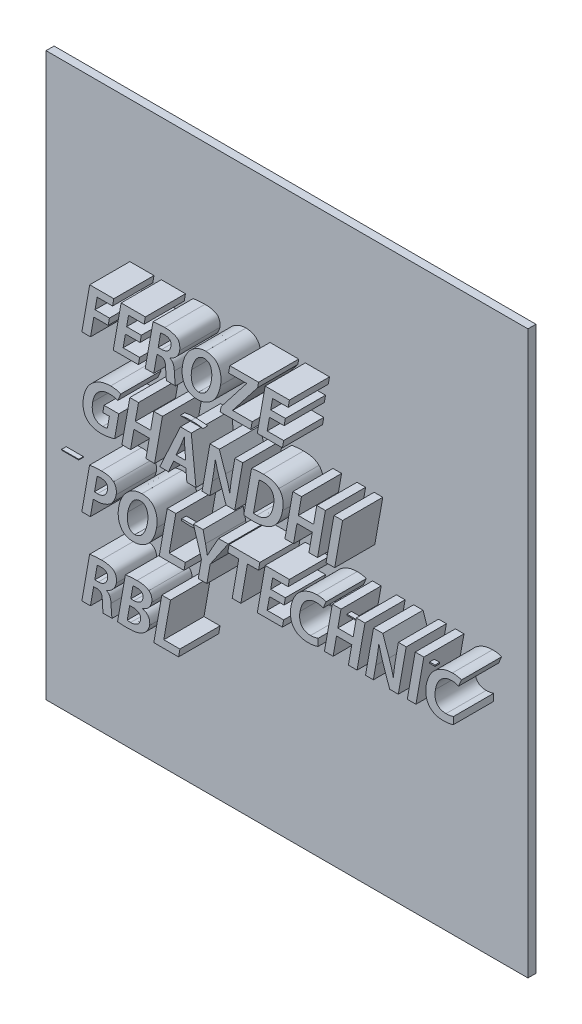
from build123d import *

# Parameters (mm, degrees)
SKETCH1_W           = 120
SKETCH1_H           = 140
BOSS_EXTRUDE1_DEPTH = 9
BOSS_EXTRUDE2_DEPTH = 120
SKETCH3_W           = 25
SKETCH3_H           = 17
SKETCH3_W_2         = 30
CUT_EXTRUDE4_DEPTH  = 120
SKETCH4_W           = 4.281609731
SKETCH4_H           = 22.352
BOSS_EXTRUDE3_DEPTH = 1.15
SKETCH5_W           = 120
SKETCH5_H           = 140
CUT_EXTRUDE5_DEPTH  = 7
SKETCH7_W           = 98.697358537
SKETCH7_H           = 22.091396752
CUT_EXTRUDE6_DEPTH  = 1.4
BOSS_EXTRUDE4_DEPTH = 10


with BuildPart() as part:
    # Sketch1 → Boss-Extrude1 (new body)
    with BuildSketch(Plane.XY):
        with Locations((60, 70)):
            Rectangle(SKETCH1_W, SKETCH1_H)
    extrude(amount=BOSS_EXTRUDE1_DEPTH)

    # Sketch2 → Boss-Extrude2 (add)
    with BuildSketch(Plane(origin=(120, 0, 0), x_dir=(0, 0, -1), z_dir=(1, 0, 0))):
        with BuildLine():
            Line((0, 27.064752917), (0, 26.435247083))
            ThreePointArc((0, 26.435247083), (0.864592662, 23.366908664), (3, 21))
            Line((3, 21), (17, 21))
            Line((17, 21), (17, 21.82131311))
            Line((17, 21.82131311), (3.570477673, 21.82131311))
            ThreePointArc((3.570477673, 21.82131311), (0.99292103, 26.75), (3.570477673, 31.67868689))
            Line((3.570477673, 31.67868689), (17, 31.67868689))
            Line((17, 31.67868689), (17, 32.5))
            Line((17, 32.5), (3, 32.5))
            ThreePointArc((3, 32.5), (0.864592662, 30.133091336), (0, 27.064752917))
        make_face()
    extrude(amount=-BOSS_EXTRUDE2_DEPTH)

    # Sketch3 → Cut-Extrude4 (cut)
    with BuildSketch(Plane.XZ):
        with Locations((12.5, -8.5)):
            Rectangle(SKETCH3_W, SKETCH3_H)
        with Locations((107.5, -8.5)):
            Rectangle(SKETCH3_W, SKETCH3_H)
        with Locations((60, -8.5)):
            Rectangle(SKETCH3_W_2, SKETCH3_H)
    extrude(amount=-CUT_EXTRUDE4_DEPTH, mode=Mode.SUBTRACT)

    # Sketch4 → Boss-Extrude3 (add)
    with BuildSketch(Plane.XY.offset(9)):
        Polygon((16.290382657, 73.275733969), (23.456083319, 73.275733969), (23.456083319, 76.748217263), (16.290382657, 76.748217263), (16.290382657, 82.715490264), (23.98040288, 82.715490264), (23.98040288, 86.187977674), (12.008772927, 86.187977674), (12.008772927, 63.925368471), (16.290382657, 63.925368471), align=None)
        with BuildLine():
            Line((42.757688712, 76.45322475), (42.757688712, 73.031311601))
            Line((42.757688712, 73.031311601), (45.99190629, 73.031311601))
            Line((45.99190629, 73.031311601), (45.99190629, 67.369990447))
            add(Edge.make_bspline(
                [(45.99190629, 67.369990447), (45.936339695, 67.343618534), (45.818414356, 67.287651153), (45.615149719, 67.233412156), (45.385286959, 67.177285583), (45.123249978, 67.132713042), (44.831113247, 67.093122797), (44.507233666, 67.071846225), (44.151997776, 67.048388477), (43.904535436, 67.042059765), (43.775256496, 67.038753527)],
                knots=[0, 0, 0, 0, 0.653154628, 1.386147199, 2.230860804, 3.172021168, 4.212071664, 5.366447579, 6.624183111, 8, 8, 8, 8], degree=3))
            add(Edge.make_bspline(
                [(43.775256496, 67.038753527), (43.544484901, 67.043417065), (43.090636782, 67.052588633), (42.429091818, 67.154423419), (41.797383127, 67.307281655), (41.201713546, 67.53502123), (40.633696569, 67.81498593), (40.102887137, 68.166316556), (39.603566889, 68.576512379), (39.139175436, 69.050192221), (38.715951193, 69.584014791), (38.353102131, 70.186317493), (38.039543129, 70.846479184), (37.786025045, 71.570873554), (37.577142775, 72.352107248), (37.434716125, 73.196017221), (37.334714991, 74.099434178), (37.316095044, 74.723725183), (37.306492107, 75.045693162)],
                knots=[0, 0, 0, 0, 0.953676512, 1.87555272, 2.761867879, 3.637011316, 4.507417159, 5.37595959, 6.263416516, 7.1754643, 8.114589267, 9.074123104, 10.077253866, 11.132050585, 12.243927563, 13.417825685, 14.668285404, 16, 16, 16, 16], degree=3))
            add(Edge.make_bspline(
                [(37.306492107, 75.045693162), (37.317339796, 75.364868906), (37.338376607, 75.983843156), (37.444455145, 76.878511826), (37.606863236, 77.709209219), (37.828965825, 78.472628314), (38.107217964, 79.173663332), (38.449449757, 79.806166299), (38.84568947, 80.379673676), (39.310929274, 80.876567245), (39.817326106, 81.314348252), (40.35790839, 81.697091203), (40.93752613, 82.014379391), (41.548576668, 82.275639742), (42.194869644, 82.479870627), (42.87535285, 82.621200556), (43.590378882, 82.707821243), (44.078426155, 82.715696538), (44.327313913, 82.719712674)],
                knots=[0, 0, 0, 0, 1.298542789, 2.518250729, 3.66010011, 4.737713637, 5.747803493, 6.721842567, 7.65708385, 8.574936643, 9.482253959, 10.376304947, 11.263703582, 12.164756428, 13.075521448, 14.015723889, 14.988085666, 16, 16, 16, 16], degree=3))
            add(Edge.make_bspline(
                [(44.327313913, 82.719712674), (44.56194835, 82.715920761), (45.013345786, 82.708625754), (45.662109423, 82.668941582), (46.253661579, 82.595249242), (46.793596667, 82.506146013), (47.285112338, 82.382677917), (47.741686998, 82.256706365), (48.159977679, 82.103607401), (48.422655308, 81.987779272), (48.549921025, 81.931661247)],
                knots=[0, 0, 0, 0, 1.300829087, 2.50257772, 3.600788493, 4.604486954, 5.533740486, 6.408714025, 7.229031605, 8, 8, 8, 8], degree=3))
            Line((48.549921025, 81.931661247), (49.434729832, 85.503778591))
            add(Edge.make_bspline(
                [(49.434729832, 85.503778591), (49.289399154, 85.569129009), (48.983148456, 85.706839859), (48.483931772, 85.890182345), (47.915187931, 86.040189909), (47.28789138, 86.184816848), (46.60296735, 86.302016017), (45.868555376, 86.385020128), (45.086546304, 86.435120661), (44.549334765, 86.444452514), (44.272529589, 86.449260872)],
                knots=[0, 0, 0, 0, 0.723124712, 1.523817615, 2.410092779, 3.390664769, 4.445079126, 5.5617063, 6.743637714, 8, 8, 8, 8], degree=3))
            add(Edge.make_bspline(
                [(44.272529589, 86.449260872), (43.868936965, 86.439324435), (43.077416733, 86.419837232), (41.918258748, 86.273427847), (40.814214264, 86.038080457), (39.762486817, 85.713011042), (38.764489199, 85.296687442), (37.823868107, 84.781310692), (36.934517836, 84.181329051), (36.242974044, 83.607257896), (35.726646881, 83.102378435), (35.36107885, 82.702675492), (35.016286098, 82.284145048), (34.702355215, 81.841635266), (34.410312592, 81.37992042), (34.139938783, 80.899700644), (33.895085254, 80.397320667), (33.67738818, 79.87281589), (33.476607533, 79.330269073), (33.31133062, 78.76426047), (33.163217532, 78.18106235), (33.034476985, 77.578703621), (32.940905189, 76.953360397), (32.86368865, 76.308505332), (32.812667719, 75.642032849), (32.799689642, 75.190463155), (32.793106661, 74.961409586)],
                knots=[0, 0, 0, 0, 1.588252423, 3.114858529, 4.590810091, 6.026612173, 7.441653233, 8.839609889, 10.241268389, 11.658554554, 12.370162762, 13.082415096, 13.78967092, 14.503124065, 15.216405789, 15.939266766, 16.671226771, 17.414686674, 18.173812935, 18.947024519, 19.734205331, 20.542085796, 21.370222467, 22.222016626, 23.098138246, 24, 24, 24, 24], degree=3))
            add(Edge.make_bspline(
                [(32.793106661, 74.961409586), (32.804615185, 74.514327168), (32.827153081, 73.638776425), (32.974664467, 72.356681913), (33.224876629, 71.137987404), (33.509522237, 70.166628796), (33.784447025, 69.42797735), (34.014006039, 68.902642945), (34.26162804, 68.401266194), (34.531032381, 67.923781425), (34.82441679, 67.473245747), (35.128752857, 67.040645153), (35.46454807, 66.639257036), (35.703727619, 66.388497653), (35.823101186, 66.263344637)],
                knots=[0, 0, 0, 0, 1.704842656, 3.338704885, 4.913464543, 6.443981355, 7.193187298, 7.917665265, 8.629154765, 9.324799911, 10.00680261, 10.678695983, 11.34054239, 12, 12, 12, 12], degree=3))
            add(Edge.make_bspline(
                [(35.823101186, 66.263344637), (36.063875099, 66.043598778), (36.546085243, 65.603502588), (37.365364194, 65.052562953), (38.251922752, 64.586594002), (39.209043189, 64.208090107), (40.236396054, 63.912245322), (41.333794737, 63.704310855), (42.502454924, 63.579585818), (43.304354222, 63.570788874), (43.716257993, 63.566270233)],
                knots=[0, 0, 0, 0, 0.913036649, 1.828584863, 2.758893342, 3.717094375, 4.709404796, 5.752305212, 6.845448596, 8, 8, 8, 8], degree=3))
            add(Edge.make_bspline(
                [(43.716257993, 63.566270233), (44.033872555, 63.572877932), (44.658641516, 63.585875714), (45.578141469, 63.660310372), (46.465593965, 63.768534064), (47.31162056, 63.915147745), (48.099322561, 64.086876754), (48.810377401, 64.267245853), (49.437304186, 64.449364451), (49.820409123, 64.588466331), (49.999598517, 64.653528352)],
                knots=[0, 0, 0, 0, 1.189863118, 2.340539873, 3.45407261, 4.538092694, 5.555811396, 6.473485662, 7.286004554, 8, 8, 8, 8], degree=3))
            Line((49.999598517, 64.653528352), (50.00380858, 76.45322475))
            Line((50.00380858, 76.45322475), (42.757688712, 76.45322475))
        make_face()
        with Locations((62.157502167, 75.011977674)):
            Rectangle(SKETCH4_W, SKETCH4_H)
        Polygon((79.132216249, 67.308460968), (79.132216249, 73.81514885), (86.443561233, 73.81514885), (86.443561233, 77.287632144), (79.132216249, 77.287632144), (79.132216249, 82.715490264), (86.8804942, 82.715490264), (86.8804942, 86.187977674), (74.850606518, 86.187977674), (74.850606518, 63.835977674), (87.346556032, 63.835977674), (87.346556032, 67.308460968), align=None)
        Polygon((95.237165401, 86.181125518), (95.237165401, 82.452630865), (100.742520788, 82.452630865), (100.742520788, 63.781028734), (105.024130518, 63.781028734), (105.024130518, 82.452630865), (110.558614769, 82.452630865), (110.558614769, 86.181125518), align=None)
    extrude(amount=BOSS_EXTRUDE3_DEPTH)

    # Sketch5 → Cut-Extrude5 (cut)
    with BuildSketch(Plane.XY.offset(9)):
        with Locations((60, 70)):
            Rectangle(SKETCH5_W, SKETCH5_H)
    extrude(amount=-CUT_EXTRUDE5_DEPTH, mode=Mode.SUBTRACT)


with BuildPart() as cut_extrude5_piece_1:
    # of the separate pieces the step leaves, piece 1, a body of its own (cut_extrude5_pieces)
    add(part.part.solids().sort_by_distance((0, 0, 0))[0])



with BuildPart() as cut_extrude5_piece_2:
    # of the separate pieces the step leaves, piece 2, a body of its own (cut_extrude5_pieces)
    add(part.part.solids().sort_by_distance((42.757688712, 76.45322475, 9))[0])


with BuildPart() as cut_extrude5_piece_3:
    # of the separate pieces the step leaves, piece 3, a body of its own (cut_extrude5_pieces)
    add(part.part.solids().sort_by_distance((79.132216249, 67.308460968, 9))[0])


with BuildPart() as cut_extrude5_piece_4:
    # of the separate pieces the step leaves, piece 4, a body of its own (cut_extrude5_pieces)
    add(part.part.solids().sort_by_distance((16.290382657, 73.275733969, 9))[0])


with BuildPart() as cut_extrude5_piece_5:
    # of the separate pieces the step leaves, piece 5, a body of its own (cut_extrude5_pieces)
    add(part.part.solids().sort_by_distance((95.237165401, 86.181125518, 9))[0])


with BuildPart() as cut_extrude5_piece_6:
    # of the separate pieces the step leaves, piece 6, a body of its own (cut_extrude5_pieces)
    add(part.part.solids().sort_by_distance((64.298307032, 63.835977674, 9))[0])


with BuildPart() as cut_extrude6_tool:
    # Sketch7 → Cut-Extrude6 (new body)
    with BuildSketch(Plane.XY.offset(10.15)):
        with Locations((61.357452196, 75.142279298)):
            Rectangle(SKETCH7_W, SKETCH7_H)
    extrude(amount=-CUT_EXTRUDE6_DEPTH)


with BuildPart() as cut_extrude5_piece_2_1:
    add(cut_extrude5_piece_2.part)

    # Cut-Extrude6: cut by cut_extrude6_tool
    add(cut_extrude6_tool.part, mode=Mode.SUBTRACT)


with BuildPart() as cut_extrude5_piece_3_1:
    add(cut_extrude5_piece_3.part)

    # Cut-Extrude6: cut by cut_extrude6_tool
    add(cut_extrude6_tool.part, mode=Mode.SUBTRACT)


with BuildPart() as cut_extrude5_piece_4_1:
    add(cut_extrude5_piece_4.part)

    # Cut-Extrude6: cut by cut_extrude6_tool
    add(cut_extrude6_tool.part, mode=Mode.SUBTRACT)


with BuildPart() as cut_extrude5_piece_5_1:
    add(cut_extrude5_piece_5.part)

    # Cut-Extrude6: cut by cut_extrude6_tool
    add(cut_extrude6_tool.part, mode=Mode.SUBTRACT)


with BuildPart() as cut_extrude5_piece_6_1:
    add(cut_extrude5_piece_6.part)

    # Cut-Extrude6: cut by cut_extrude6_tool
    add(cut_extrude6_tool.part, mode=Mode.SUBTRACT)


with BuildPart() as cut_extrude5_piece_1_1:
    add(cut_extrude5_piece_1.part)

    add(cut_extrude5_piece_2_1.part)  # Boss-Extrude4 merges Cut-Extrude5 piece 2

    add(cut_extrude5_piece_3_1.part)  # Boss-Extrude4 merges Cut-Extrude5 piece 3

    add(cut_extrude5_piece_5_1.part)  # Boss-Extrude4 merges Cut-Extrude5 piece 5

    add(cut_extrude5_piece_6_1.part)  # Boss-Extrude4 merges Cut-Extrude5 piece 6
    # Sketch10 → Boss-Extrude4 (add)
    # profile 1 of 27: a face of its own
    with BuildSketch(Plane.XY.offset(2)):
        Polygon((21.8937194, 98.485968648), (25.476569731, 98.485968648), (25.782706771, 100.222210295), (22.19985644, 100.222210295), (22.72593328, 103.205846796), (26.570943392, 103.205846796), (26.877078374, 104.942090501), (20.876532291, 104.942090501), (18.913850556, 93.810785899), (21.069386527, 93.810785899), align=None)
    # profile 2 of 27: a face of its own
    with BuildSketch(Plane.XY.offset(2)):
        Polygon((29.189158328, 95.502332147), (29.762790777, 98.755676088), (33.418463269, 98.755676088), (33.724598251, 100.491917735), (30.068925759, 100.491917735), (30.547449049, 103.205846796), (34.421588025, 103.205846796), (34.727723007, 104.942090501), (28.69804806, 104.942090501), (26.727485317, 93.766090501), (32.99019118, 93.766090501), (33.29632822, 95.502332147), align=None)
    # profile 3 of 27: a face of its own
    with BuildSketch(Plane.XY.offset(2)):
        with BuildLine():
            Line((34.691071175, 93.807012069), (36.832042715, 93.807012069))
            Line((36.832042715, 93.807012069), (37.63326345, 98.351114928))
            Line((37.63326345, 98.351114928), (38.361485062, 98.351114928))
            add(Edge.make_bspline(
                [(38.361485062, 98.351114928), (38.42160142, 98.350688244), (38.538214688, 98.349860566), (38.706999187, 98.332617467), (38.864118158, 98.30433552), (39.007355158, 98.25974485), (39.138025862, 98.203757379), (39.252774679, 98.12980845), (39.357518003, 98.046408928), (39.447520469, 97.94501582), (39.523736557, 97.826292815), (39.591386844, 97.689899074), (39.65025983, 97.533309667), (39.697727273, 97.356060779), (39.735424643, 97.159561507), (39.761800696, 96.943386958), (39.780932688, 96.707182368), (39.786299026, 96.542569634), (39.789093674, 96.456843635)],
                knots=[0, 0, 0, 0, 1.049085714, 2.035008775, 2.958558881, 3.831293243, 4.649329131, 5.431850554, 6.207519896, 6.98047031, 7.786562074, 8.664022082, 9.634262848, 10.702260121, 11.863872375, 13.124803797, 14.502673163, 16, 16, 16, 16], degree=3))
            add(Edge.make_bspline(
                [(39.789093674, 96.456843635), (39.79264259, 96.293169704), (39.799437613, 95.979787228), (39.819693543, 95.530321417), (39.840204056, 95.122587732), (39.873403064, 94.759680472), (39.905258885, 94.444678258), (39.941919636, 94.182922625), (39.973268131, 93.974122013), (40.006602082, 93.856488285), (40.020873505, 93.806125199)],
                knots=[0, 0, 0, 0, 1.473822281, 2.821891505, 4.05058622, 5.148625094, 6.102503929, 6.900195361, 7.529135417, 8, 8, 8, 8], degree=3))
            Line((40.020873505, 93.806125199), (42.235447075, 93.807012069))
            add(Edge.make_bspline(
                [(42.235447075, 93.807012069), (42.217268876, 93.874575016), (42.175426442, 94.03009086), (42.139909249, 94.300935428), (42.096945153, 94.634012338), (42.069837596, 95.025336822), (42.041689084, 95.458123786), (42.00838203, 95.917986277), (41.980537406, 96.398595421), (41.959569661, 96.725859474), (41.948860285, 96.893011137)],
                knots=[0, 0, 0, 0, 0.540610849, 1.244373687, 2.108850446, 3.138771367, 4.276652923, 5.463680299, 6.704562721, 8, 8, 8, 8], degree=3))
            add(Edge.make_bspline(
                [(41.948860285, 96.893011137), (41.939951547, 97.029514776), (41.922834229, 97.291793898), (41.861193047, 97.664638715), (41.776634449, 98.001695963), (41.661477833, 98.300487217), (41.515902359, 98.56439442), (41.331158715, 98.785637988), (41.108690595, 98.967158234), (40.938011869, 99.050405569), (40.85106672, 99.092812447)],
                knots=[0, 0, 0, 0, 1.2619847, 2.424786929, 3.483036711, 4.464230868, 5.372901186, 6.251948279, 7.109528057, 8, 8, 8, 8], degree=3))
            Line((40.85106672, 99.092812447), (40.859534174, 99.137246517))
            add(Edge.make_bspline(
                [(40.859534174, 99.137246517), (41.001052706, 99.193896444), (41.285126089, 99.307611136), (41.681520622, 99.546456875), (42.055963719, 99.831746328), (42.345423654, 100.107283362), (42.557737519, 100.353394095), (42.705541967, 100.548216076), (42.836220993, 100.754892415), (42.955547796, 100.969093473), (43.055681693, 101.196389951), (43.144818554, 101.432372722), (43.218837593, 101.678821831), (43.255655505, 101.847911864), (43.274219504, 101.933168927)],
                knots=[0, 0, 0, 0, 1.418509646, 2.847406831, 4.295170472, 5.799594488, 6.560603024, 7.322427292, 8.075883961, 8.837455165, 9.604993196, 10.387864992, 11.187143714, 12, 12, 12, 12], degree=3))
            add(Edge.make_bspline(
                [(43.274219504, 101.933168927), (43.283773723, 102.020180151), (43.302462327, 102.190379128), (43.310877594, 102.440173993), (43.313339288, 102.677937215), (43.297024817, 102.902193959), (43.273749928, 103.115227246), (43.232140327, 103.314610268), (43.18407467, 103.50323387), (43.116267474, 103.676730267), (43.042165549, 103.840560682), (42.950895561, 103.989367106), (42.848721169, 104.127022589), (42.732571343, 104.250273727), (42.605408803, 104.364146109), (42.463619675, 104.461909642), (42.310637846, 104.550258913), (42.089661567, 104.644781789), (41.807416753, 104.743666909), (41.473072013, 104.854948197), (41.140577043, 104.936861416), (40.814970236, 105.006577847), (40.493724047, 105.051097219), (40.17893608, 105.083407064), (39.868319611, 105.08852654), (39.663337073, 105.079381348), (39.561528021, 105.074839189)],
                knots=[0, 0, 0, 0, 1.0851818, 2.122678254, 3.09828471, 4.0323297, 4.909656232, 5.753567757, 6.556519513, 7.320141772, 8.060557386, 8.783603929, 9.480465684, 10.183074626, 10.880426189, 11.593327174, 12.315060757, 13.067723876, 14.569542808, 16.024059148, 17.43533862, 18.813981682, 20.151815601, 21.455437262, 22.736187364, 24, 24, 24, 24], degree=3))
            add(Edge.make_bspline(
                [(39.561528021, 105.074839189), (39.29174055, 105.071671946), (38.76295847, 105.065464165), (38.11257625, 105.023002455), (37.617073223, 104.977536803), (37.271446282, 104.939681313), (36.946776098, 104.898227199), (36.737958575, 104.865312029), (36.636887965, 104.849380626)],
                knots=[0, 0, 0, 0, 1.653767981, 3.241376882, 3.993738712, 4.704122739, 5.372777229, 6, 6, 6, 6], degree=3))
            Line((36.636887965, 104.849380626), (34.691071175, 93.807012069))
        make_face()
        with BuildLine():
            add(Edge.make_bspline(
                [(38.521278161, 103.387465965), (38.577046424, 103.401063418), (38.705751625, 103.432444401), (38.930263731, 103.456202671), (39.209453044, 103.469507479), (39.414004461, 103.472058293), (39.525707501, 103.473451262)],
                knots=[0, 0, 0, 0, 0.680942246, 1.571517628, 2.673835324, 4, 4, 4, 4], degree=3))
            add(Edge.make_bspline(
                [(39.525707501, 103.473451262), (39.629894095, 103.474126992), (39.836488723, 103.475466918), (40.139987305, 103.416239676), (40.429274345, 103.310023586), (40.657952252, 103.187997775), (40.823090804, 103.058169312), (40.926498828, 102.935038065), (41.005612581, 102.78893421), (41.069278925, 102.622326734), (41.101022051, 102.431581016), (41.118537586, 102.220835215), (41.113485861, 101.987927531), (41.094776071, 101.82628455), (41.084953641, 101.741423794)],
                knots=[0, 0, 0, 0, 1.347358564, 2.671716518, 3.978700963, 5.331090436, 6.010462107, 6.688613642, 7.397514821, 8.154823268, 8.988347076, 9.892228492, 10.893443543, 12, 12, 12, 12], degree=3))
            add(Edge.make_bspline(
                [(41.084953641, 101.741423794), (41.071362868, 101.675120008), (41.044606977, 101.544589031), (40.985070084, 101.356260977), (40.910201729, 101.178683863), (40.825310895, 101.009480836), (40.722144614, 100.852386666), (40.607245439, 100.705066649), (40.476595686, 100.569059668), (40.33415331, 100.442761541), (40.178220892, 100.32924559), (40.012062619, 100.229781693), (39.834859056, 100.14782831), (39.648677719, 100.077167948), (39.45095235, 100.023336473), (39.243880285, 99.983410805), (39.026963183, 99.957383721), (38.878905289, 99.952765972), (38.802975845, 99.950397823)],
                knots=[0, 0, 0, 0, 1.024491294, 2.016896151, 2.984830465, 3.941004722, 4.879202267, 5.826102295, 6.766528126, 7.731125432, 8.705525333, 9.683286643, 10.65873098, 11.658405468, 12.695791544, 13.757592581, 14.850012359, 16, 16, 16, 16], degree=3))
            Line((38.802975845, 99.950397823), (37.915621658, 99.952502855))
            Line((37.915621658, 99.952502855), (38.521278161, 103.387465965))
        make_face(mode=Mode.SUBTRACT)
    # profile 4 of 27: a face of its own
    with BuildSketch(Plane.XY.offset(2)):
        with BuildLine():
            add(Edge.make_bspline(
                [(49.802227262, 105.076944221), (49.619913735, 105.067716597), (49.259891757, 105.049494432), (48.732104704, 104.963330496), (48.225075814, 104.833133797), (47.739317171, 104.653595383), (47.276633125, 104.421741541), (46.834490057, 104.145012577), (46.414098807, 103.819416524), (46.018861648, 103.447927783), (45.650973835, 103.036529495), (45.312824834, 102.594222618), (45.011493049, 102.119246), (44.740894939, 101.616864224), (44.504275534, 101.083615988), (44.303013381, 100.519879775), (44.132641027, 99.926721129), (44.049656275, 99.517694366), (44.007486607, 99.309842652)],
                knots=[0, 0, 0, 0, 0.984777037, 1.944679486, 2.880814253, 3.806922064, 4.734394764, 5.669584704, 6.618287852, 7.600030091, 8.593416825, 9.594371643, 10.601946487, 11.626519208, 12.672062413, 13.74780785, 14.855522329, 16, 16, 16, 16], degree=3))
            add(Edge.make_bspline(
                [(44.007486607, 99.309842652), (43.976874037, 99.108586975), (43.917230422, 98.716473012), (43.872001033, 98.138417599), (43.872110744, 97.588316449), (43.910495967, 97.065925688), (43.992006083, 96.571257366), (44.11634988, 96.104486224), (44.283450067, 95.665884056), (44.457345628, 95.322458682), (44.617850683, 95.066661268), (44.745975369, 94.88547057), (44.888606553, 94.719978582), (45.03757941, 94.562841361), (45.198333428, 94.419194878), (45.370129256, 94.288444331), (45.551156073, 94.167767163), (45.743114781, 94.060738314), (45.945195532, 93.965168459), (46.157004257, 93.881241364), (46.379691905, 93.80987824), (46.611554145, 93.748225765), (46.853722225, 93.700345488), (47.106202773, 93.664233948), (47.368638411, 93.641591385), (47.547358397, 93.634721201), (47.638001604, 93.63123678)],
                knots=[0, 0, 0, 0, 1.861367272, 3.626571453, 5.296684739, 6.887979543, 8.411814921, 9.874924158, 11.298134526, 12.697177938, 13.386920835, 14.058968854, 14.724352992, 15.383099794, 16.03817212, 16.693401896, 17.356145303, 18.026225748, 18.701458846, 19.399260489, 20.108207956, 20.838937222, 21.592270397, 22.364428985, 23.17047105, 24, 24, 24, 24], degree=3))
            add(Edge.make_bspline(
                [(47.638001604, 93.63123678), (47.812438266, 93.635488268), (48.156409431, 93.643871765), (48.662736361, 93.716490674), (49.152051789, 93.829254329), (49.623768424, 93.989992684), (50.077342557, 94.198109532), (50.513279441, 94.452427303), (50.930932662, 94.753050305), (51.330403924, 95.097380821), (51.705939967, 95.486258584), (52.048325453, 95.924569104), (52.360899866, 96.406689228), (52.640477209, 96.934444786), (52.886943139, 97.507297232), (53.103526312, 98.123976103), (53.289665103, 98.786279218), (53.384097838, 99.246663497), (53.432497392, 99.482623981)],
                knots=[0, 0, 0, 0, 0.928883763, 1.831663297, 2.719326822, 3.6008809, 4.481600756, 5.373661973, 6.285377003, 7.219259146, 8.179887202, 9.16050111, 10.177615646, 11.237211632, 12.338279952, 13.496873389, 14.717073987, 16, 16, 16, 16], degree=3))
            add(Edge.make_bspline(
                [(53.432497392, 99.482623981), (53.462539702, 99.670514818), (53.521287752, 100.037937312), (53.562853326, 100.582485717), (53.565203557, 101.104939392), (53.531643025, 101.606390848), (53.452304146, 102.086169626), (53.337823541, 102.545268908), (53.180527382, 102.981876119), (53.017658894, 103.327806895), (52.866675559, 103.58923717), (52.742392973, 103.773876737), (52.604221289, 103.944506095), (52.457158448, 104.105043495), (52.298451491, 104.253615472), (52.127401837, 104.388216946), (51.944795253, 104.511121771), (51.751301676, 104.622611031), (51.54638557, 104.721908163), (51.330463778, 104.807717503), (51.104390369, 104.884513938), (50.865652732, 104.947322264), (50.615806922, 104.99749779), (50.354059295, 105.034985975), (50.082048233, 105.063107733), (49.896164584, 105.070894066), (49.801982395, 105.074839189)],
                knots=[0, 0, 0, 0, 1.757861596, 3.437516706, 5.040761854, 6.583038089, 8.075897973, 9.528942611, 10.949705392, 12.357853881, 13.055880911, 13.738189064, 14.412297294, 15.082959301, 15.748861539, 16.418926494, 17.092221754, 17.781380347, 18.481005005, 19.194552275, 19.927325078, 20.686195793, 21.474155415, 22.281029606, 23.129044463, 24, 24, 24, 24], degree=3))
            Line((49.801982395, 105.074839189), (49.802227262, 105.076944221))
        make_face()
        with BuildLine():
            add(Edge.make_bspline(
                [(49.437832493, 103.340700516), (49.535653203, 103.331786201), (49.724141917, 103.314609389), (49.993788771, 103.251856334), (50.237662376, 103.152340286), (50.4542582, 103.015953606), (50.645957941, 102.8465529), (50.808712614, 102.641032297), (50.946414098, 102.402283956), (51.05566122, 102.1319052), (51.142629047, 101.839400552), (51.207095281, 101.529699277), (51.253647237, 101.207453953), (51.279142984, 100.870971782), (51.280366643, 100.52113085), (51.259977039, 100.157687441), (51.224039589, 99.780282929), (51.180933059, 99.525948462), (51.158947954, 99.396233317)],
                knots=[0, 0, 0, 0, 0.956331566, 1.842735625, 2.686615713, 3.510699801, 4.325122411, 5.167335848, 6.053554956, 7.001665462, 8.001962107, 9.023409207, 10.081256231, 11.172490531, 12.308556355, 13.48727378, 14.718464499, 16, 16, 16, 16], degree=3))
            add(Edge.make_bspline(
                [(51.158947954, 99.396233317), (51.132294742, 99.25545016), (51.079779144, 98.978061015), (50.977524548, 98.574111556), (50.862687539, 98.188411725), (50.730969639, 97.821328439), (50.585131514, 97.472207684), (50.419718801, 97.142857002), (50.240322828, 96.831366373), (50.046245098, 96.540716539), (49.839538767, 96.273500951), (49.615173272, 96.041810341), (49.381262501, 95.840643609), (49.131705271, 95.677849628), (48.87196387, 95.544732698), (48.597889805, 95.450778817), (48.312225744, 95.38693343), (48.116645382, 95.374032797), (48.017277692, 95.367478427)],
                knots=[0, 0, 0, 0, 1.245593338, 2.454228735, 3.621197729, 4.74351186, 5.843725712, 6.908871897, 7.945879782, 8.967232725, 9.945824929, 10.878741526, 11.767035374, 12.622411208, 13.463608013, 14.297971407, 15.135257508, 16, 16, 16, 16], degree=3))
            add(Edge.make_bspline(
                [(48.017277692, 95.367478427), (47.922134303, 95.37400058), (47.737655061, 95.386646773), (47.472943173, 95.44823125), (47.233185712, 95.545913184), (47.01545033, 95.67568902), (46.825247336, 95.843053214), (46.655658099, 96.041230822), (46.515189489, 96.276614648), (46.398661811, 96.541986102), (46.305993716, 96.832179882), (46.231290259, 97.141149024), (46.181670523, 97.468244023), (46.154440397, 97.812575637), (46.151483376, 98.173608786), (46.168266171, 98.552076818), (46.20865604, 98.948005923), (46.250956225, 99.216607234), (46.272607688, 99.354091529)],
                knots=[0, 0, 0, 0, 0.918047024, 1.780056607, 2.605906764, 3.404595667, 4.210764859, 5.036753709, 5.908594008, 6.841935856, 7.824472593, 8.840752702, 9.902456122, 11.00931256, 12.166896915, 13.379763896, 14.658825184, 16, 16, 16, 16], degree=3))
            add(Edge.make_bspline(
                [(46.272607688, 99.354091529), (46.297555718, 99.484240699), (46.347006943, 99.742218415), (46.438563518, 100.121306953), (46.551262352, 100.485674798), (46.677908079, 100.837509676), (46.820414521, 101.176318925), (46.981255513, 101.501859591), (47.158517108, 101.81426392), (47.350534236, 102.111460121), (47.555598683, 102.3883033), (47.782129694, 102.628893832), (48.021765005, 102.835976055), (48.276316414, 103.007946431), (48.545389252, 103.146624904), (48.829600128, 103.247663186), (49.128348093, 103.314945303), (49.333165741, 103.33061749), (49.437455933, 103.338597542)],
                knots=[0, 0, 0, 0, 1.157137777, 2.293643231, 3.403387079, 4.48598583, 5.557916603, 6.611208606, 7.654957319, 8.692705972, 9.699806274, 10.658746849, 11.572140237, 12.460119192, 13.335146404, 14.208150728, 15.087616194, 16, 16, 16, 16], degree=3))
            Line((49.437455933, 103.338597542), (49.437832493, 103.340700516))
        make_face(mode=Mode.SUBTRACT)
    # profile 5 of 27: a face of its own
    with BuildSketch(Plane.XY.offset(2)):
        Polygon((55.767500174, 104.942090501), (55.461365192, 103.205846796), (59.932645889, 103.205846796), (59.922382059, 103.147632279), (53.578870142, 95.007378087), (53.360609429, 93.769514521), (60.992371922, 93.769514521), (61.321077865, 95.633761847), (56.471121929, 95.633761847), (56.481391932, 95.69200723), (62.691504927, 103.653909886), (62.918636404, 104.942090501), align=None)
    # profile 6 of 27: a face of its own
    with BuildSketch(Plane.XY.offset(2)):
        Polygon((65.060247889, 95.502332147), (65.633880337, 98.755676088), (69.28955283, 98.755676088), (69.595687812, 100.491917735), (65.94001532, 100.491917735), (66.41853861, 103.205846796), (70.292677586, 103.205846796), (70.598812568, 104.942090501), (64.569137621, 104.942090501), (62.598574878, 93.766090501), (68.861280741, 93.766090501), (69.167417781, 95.502332147), align=None)
    # profile 7 of 27: a face of its own
    with BuildSketch(Plane.XY.offset(2)):
        with BuildLine():
            Line((24.445900543, 80.734608098), (24.144222548, 79.023651523))
            Line((24.144222548, 79.023651523), (25.760874527, 79.023651523))
            Line((25.760874527, 79.023651523), (25.261770076, 76.192997119))
            add(Edge.make_bspline(
                [(25.261770076, 76.192997119), (25.231484397, 76.179871217), (25.168310926, 76.15249165), (25.061809909, 76.124643565), (24.942597966, 76.096715873), (24.807405565, 76.074360942), (24.657810154, 76.054705834), (24.493089676, 76.04389335), (24.31405936, 76.032257957), (24.189629507, 76.029042722), (24.124991242, 76.027372486)],
                knots=[0, 0, 0, 0, 0.684733295, 1.428298087, 2.281337057, 3.228848893, 4.273094435, 5.414548801, 6.656921348, 8, 8, 8, 8], degree=3))
            add(Edge.make_bspline(
                [(24.124991242, 76.027372486), (24.01029309, 76.02957747), (23.787519217, 76.033860125), (23.465109269, 76.08502371), (23.162918589, 76.160842482), (22.883888382, 76.273787126), (22.625622202, 76.415744601), (22.389918849, 76.590325678), (22.17581283, 76.796131095), (21.985082443, 77.033424972), (21.822277364, 77.302357188), (21.691289023, 77.602840399), (21.592124329, 77.933824026), (21.528833459, 78.295891078), (21.49509182, 78.687202819), (21.497456086, 79.108487009), (21.528736395, 79.560450113), (21.573352896, 79.870236076), (21.596483989, 80.030842304)],
                knots=[0, 0, 0, 0, 0.990541583, 1.923891362, 2.814808415, 3.678413403, 4.518148851, 5.356016631, 6.206221913, 7.078554159, 7.980266613, 8.915431328, 9.904613696, 10.95973612, 12.087128066, 13.29532597, 14.597781869, 16, 16, 16, 16], degree=3))
            add(Edge.make_bspline(
                [(21.596483989, 80.030842304), (21.630188878, 80.190790019), (21.695892324, 80.502587993), (21.827136501, 80.949657435), (21.980371013, 81.365151731), (22.158584259, 81.747035609), (22.362807404, 82.095463517), (22.587623571, 82.412676217), (22.837060345, 82.698028513), (23.113024608, 82.945671089), (23.403906295, 83.165009513), (23.707389071, 83.355522088), (24.02457245, 83.514573159), (24.353016781, 83.645285433), (24.693630691, 83.7467846), (25.046110078, 83.818547047), (25.41063183, 83.861638743), (25.658132812, 83.865765533), (25.783270582, 83.86785206)],
                knots=[0, 0, 0, 0, 1.258441542, 2.453173664, 3.584474853, 4.666078177, 5.693951995, 6.69056724, 7.65633608, 8.605975055, 9.540646414, 10.459151449, 11.361427485, 12.269424723, 13.178146651, 14.09467469, 15.036657718, 16, 16, 16, 16], degree=3))
            add(Edge.make_bspline(
                [(25.783270582, 83.86785206), (25.900586522, 83.865940883), (26.126282782, 83.862264099), (26.449288753, 83.84270736), (26.742264212, 83.805671303), (27.007292138, 83.761082202), (27.247967268, 83.70027244), (27.467928959, 83.633232056), (27.670721281, 83.561312234), (27.794613547, 83.500927139), (27.85453944, 83.471719257)],
                knots=[0, 0, 0, 0, 1.323660886, 2.546502284, 3.64825809, 4.653961709, 5.576434237, 6.446217856, 7.248445559, 8, 8, 8, 8], degree=3))
            Line((27.85453944, 83.471719257), (28.622760769, 85.259948807))
            add(Edge.make_bspline(
                [(28.622760769, 85.259948807), (28.554649671, 85.292747114), (28.409414734, 85.362683733), (28.169264726, 85.452963296), (27.892729524, 85.52852068), (27.585308501, 85.600627385), (27.247710171, 85.658970456), (26.882631866, 85.700863289), (26.492285678, 85.725441418), (26.222984268, 85.730187198), (26.084584363, 85.732626159)],
                knots=[0, 0, 0, 0, 0.696727074, 1.485647933, 2.360834666, 3.337795526, 4.395926991, 5.517139986, 6.724003742, 8, 8, 8, 8], degree=3))
            add(Edge.make_bspline(
                [(26.084584363, 85.732626159), (25.881389084, 85.727585033), (25.48005106, 85.717628132), (24.888004206, 85.644004281), (24.315239745, 85.525968425), (23.760821607, 85.363705431), (23.226030006, 85.154951644), (22.711882032, 84.897439497), (22.215102494, 84.597666507), (21.73965436, 84.25368271), (21.295079284, 83.86443186), (20.888915021, 83.432395618), (20.522251513, 82.960490169), (20.198895549, 82.445700242), (19.919481883, 81.889424551), (19.67889348, 81.293980922), (19.476418619, 80.658235036), (19.380409614, 80.215085692), (19.331362908, 79.988700516)],
                knots=[0, 0, 0, 0, 1.007956924, 1.990850586, 2.95516629, 3.906780398, 4.85351373, 5.799477151, 6.756283517, 7.729343029, 8.707220219, 9.683444403, 10.666967955, 11.667627779, 12.6946385, 13.751364669, 14.851272798, 16, 16, 16, 16], degree=3))
            add(Edge.make_bspline(
                [(19.331362908, 79.988700516), (19.312811076, 79.875761516), (19.276265454, 79.653280748), (19.239328815, 79.321983775), (19.213662576, 78.998742956), (19.200235856, 78.683135441), (19.2027974, 78.375183895), (19.217544521, 78.075028406), (19.2439404, 77.782307158), (19.286858974, 77.497685303), (19.340436747, 77.223139778), (19.408500847, 76.960153136), (19.488129542, 76.70951754), (19.58054936, 76.470682796), (19.687233125, 76.244995791), (19.801286617, 76.029049787), (19.933286195, 75.827779848), (20.030773879, 75.702253445), (20.079379637, 75.639668041)],
                knots=[0, 0, 0, 0, 1.20865444, 2.380952281, 3.519433113, 4.633063374, 5.716156125, 6.77082953, 7.806468839, 8.818865601, 9.809614304, 10.759616329, 11.686306364, 12.585876691, 13.462017973, 14.321673468, 15.16321394, 16, 16, 16, 16], degree=3))
            add(Edge.make_bspline(
                [(20.079379637, 75.639668041), (20.180307133, 75.529718955), (20.382959522, 75.308952106), (20.745450723, 75.032870488), (21.149020539, 74.800281084), (21.595023523, 74.610583924), (22.083328159, 74.463395953), (22.613986729, 74.359426336), (23.1879579, 74.297592881), (23.584713504, 74.293334035), (23.789964031, 74.291130839)],
                knots=[0, 0, 0, 0, 0.877109237, 1.761148261, 2.668827383, 3.613418982, 4.607387768, 5.665502576, 6.792312391, 8, 8, 8, 8], degree=3))
            add(Edge.make_bspline(
                [(23.789964031, 74.291130839), (23.950173077, 74.294476993), (24.267458458, 74.30110387), (24.737015215, 74.338354073), (25.196111071, 74.392747694), (25.638754134, 74.465942987), (26.054500982, 74.551251253), (26.432883809, 74.64261811), (26.769674497, 74.732705117), (26.977574595, 74.802214581), (27.07491637, 74.834759899)],
                knots=[0, 0, 0, 0, 1.150273477, 2.278054633, 3.380143369, 4.468638951, 5.49814935, 6.426468816, 7.263250372, 8, 8, 8, 8], degree=3))
            Line((27.07491637, 74.834759899), (28.116137467, 80.734608098))
            Line((28.116137467, 80.734608098), (24.445900543, 80.734608098))
        make_face()
    # profile 8 of 27: a face of its own
    with BuildSketch(Plane.XY.offset(2)):
        Polygon((36.830244281, 85.619668472), (36.041863621, 81.148387774), (32.225982374, 81.148387774), (33.014363034, 85.619668472), (30.858827063, 85.619668472), (28.891727436, 74.463313376), (31.047263407, 74.463313376), (31.897276431, 79.284140448), (35.713157678, 79.284140448), (34.863144654, 74.463313376), (37.018680625, 74.463313376), (38.985780252, 85.619668472), align=None)
    # profile 9 of 27: a face of its own
    with BuildSketch(Plane.XY.offset(2)):
        Polygon((43.464028337, 85.60198456), (38.320217799, 74.436184601), (40.504882635, 74.436184601), (41.798104625, 77.392764345), (44.798377666, 77.392764345), (45.078114358, 74.436184601), (47.335601355, 74.436184601), (46.173012734, 85.60198456), align=None)
        with BuildLine():
            add(Edge.make_bspline(
                [(43.511637446, 81.57669896), (43.584491337, 81.755233687), (43.737273673, 82.12963994), (43.965413131, 82.705020923), (44.189885808, 83.289620685), (44.3383159, 83.676803323), (44.409940678, 83.863637881)],
                knots=[0, 0, 0, 0, 0.94172347, 1.974893965, 3.022787305, 4, 4, 4, 4], degree=3))
            Line((44.409940678, 83.863637881), (44.454127824, 83.865740855))
            add(Edge.make_bspline(
                [(44.454127824, 83.865740855), (44.460572524, 83.681727328), (44.473978747, 83.298943571), (44.49232168, 82.717186999), (44.521979189, 82.132835744), (44.545861878, 81.747397079), (44.557436935, 81.560589192)],
                knots=[0, 0, 0, 0, 0.957501347, 1.991788149, 3.026693875, 4, 4, 4, 4], degree=3))
            Line((44.557436935, 81.560589192), (44.774882797, 78.99415433))
            Line((44.774882797, 78.99415433), (42.386315909, 78.99415433))
            Line((42.386315909, 78.99415433), (43.511637446, 81.57669896))
        make_face(mode=Mode.SUBTRACT)
    # profile 10 of 27: a face of its own
    with BuildSketch(Plane.XY.offset(2)):
        with BuildLine():
            Line((57.018506299, 85.60198456), (56.426564397, 82.244790332))
            add(Edge.make_bspline(
                [(56.426564397, 82.244790332), (56.386545519, 82.021762665), (56.307819037, 81.583015141), (56.203946973, 80.933019374), (56.105817383, 80.303263094), (56.019936861, 79.691288237), (55.941773444, 79.0970876), (55.872071879, 78.521214822), (55.812180997, 77.963553359), (55.780586918, 77.597914514), (55.765045333, 77.418051476)],
                knots=[0, 0, 0, 0, 1.115815706, 2.195070172, 3.241416701, 4.254441794, 5.238181321, 6.192739435, 7.110982376, 8, 8, 8, 8], degree=3))
            Line((55.765045333, 77.418051476), (55.736025527, 77.419802582))
            add(Edge.make_bspline(
                [(55.736025527, 77.419802582), (55.668526888, 77.721071442), (55.530286109, 78.338085991), (55.27960161, 79.260390159), (55.009095016, 80.177328817), (54.803522622, 80.775326376), (54.703072287, 81.067530277)],
                knots=[0, 0, 0, 0, 0.976508967, 1.999941972, 3.022697081, 4, 4, 4, 4], degree=3))
            Line((54.703072287, 81.067530277), (53.14400311, 85.599914509))
            Line((53.14400311, 85.599914509), (50.813693952, 85.599914509))
            Line((50.813693952, 85.599914509), (48.838890279, 74.399866117))
            Line((48.838890279, 74.399866117), (50.790524199, 74.399866117))
            Line((50.790524199, 74.399866117), (51.396575782, 77.837072125))
            add(Edge.make_bspline(
                [(51.396575782, 77.837072125), (51.438518079, 78.078723648), (51.520643685, 78.551892236), (51.634936326, 79.244814303), (51.744846751, 79.903732418), (51.838295174, 80.530693798), (51.926022443, 81.128931488), (52.002842767, 81.702321895), (52.076433064, 82.251874295), (52.116871125, 82.611250537), (52.136637425, 82.786915209)],
                knots=[0, 0, 0, 0, 1.175934248, 2.302551789, 3.367169025, 4.378743966, 5.341707754, 6.266114765, 7.152469346, 8, 8, 8, 8], degree=3))
            Line((52.136637425, 82.786915209), (52.196878781, 82.788979087))
            add(Edge.make_bspline(
                [(52.196878781, 82.788979087), (52.265408461, 82.474385669), (52.404843621, 81.834292441), (52.665126896, 80.883053408), (52.947483078, 79.944296656), (53.15155097, 79.330139705), (53.251287706, 79.029974849)],
                knots=[0, 0, 0, 0, 0.988895783, 2.012074817, 3.02841566, 4, 4, 4, 4], degree=3))
            Line((53.251287706, 79.029974849), (54.839436362, 74.399866117))
            Line((54.839436362, 74.399866117), (56.994972333, 74.399866117))
            Line((56.994972333, 74.399866117), (58.969776006, 85.599914509))
            Line((58.969776006, 85.599914509), (57.018506299, 85.60198456))
        make_face()
    # profile 11 of 27: a face of its own
    with BuildSketch(Plane.XY.offset(2)):
        with BuildLine():
            add(Edge.make_bspline(
                [(59.230690875, 74.445594483), (59.304567214, 74.435212156), (59.459632271, 74.413419844), (59.70427578, 74.386102859), (59.97137224, 74.363990365), (60.260676696, 74.342177004), (60.572607661, 74.325813638), (60.90696963, 74.313194406), (61.263823607, 74.305339918), (61.508968974, 74.301526083), (61.635396338, 74.299559197)],
                knots=[0, 0, 0, 0, 0.742631349, 1.558769354, 2.450065502, 3.410504506, 4.446816696, 5.559320405, 6.741282813, 8, 8, 8, 8], degree=3))
            add(Edge.make_bspline(
                [(61.635396338, 74.299559197), (61.875052951, 74.303390528), (62.343993773, 74.310887369), (63.030978407, 74.375826803), (63.685653481, 74.478999863), (64.306154985, 74.629075953), (64.891805738, 74.818785018), (65.437045393, 75.056420836), (65.946503687, 75.332678539), (66.254940817, 75.556182061), (66.407953778, 75.667060203)],
                knots=[0, 0, 0, 0, 1.137802263, 2.226360134, 3.273643506, 4.282389232, 5.254824629, 6.192896154, 7.103511596, 8, 8, 8, 8], degree=3))
            add(Edge.make_bspline(
                [(66.407953778, 75.667060203), (66.472485224, 75.716877298), (66.60319724, 75.817784583), (66.791885994, 75.986629522), (66.978063422, 76.17102452), (67.162889121, 76.37237384), (67.342509381, 76.591761671), (67.523245993, 76.826107439), (67.69838646, 77.07912365), (67.875304761, 77.346865895), (68.044201279, 77.63481502), (68.199468242, 77.945894837), (68.344900791, 78.277162654), (68.479469509, 78.629591847), (68.603906795, 79.003591105), (68.71709522, 79.398644124), (68.818747595, 79.815551654), (68.875711664, 80.101553112), (68.90485469, 80.247872509)],
                knots=[0, 0, 0, 0, 0.733009988, 1.484752323, 2.275379818, 3.089113432, 3.941596053, 4.824748468, 5.750045339, 6.70843144, 7.710597507, 8.750209148, 9.833522824, 10.963266427, 12.141845499, 13.377449189, 14.658293364, 16, 16, 16, 16], degree=3))
            add(Edge.make_bspline(
                [(68.90485469, 80.247872509), (68.924651147, 80.372069356), (68.963263549, 80.61431162), (69.005996304, 80.971959763), (69.031803393, 81.315760307), (69.039787284, 81.645549272), (69.034476404, 81.961338899), (69.011685146, 82.262542268), (68.971475192, 82.549531018), (68.916730725, 82.822572369), (68.847505422, 83.082451971), (68.762619912, 83.329096744), (68.666386738, 83.564232646), (68.55394773, 83.785464433), (68.430354679, 83.994578915), (68.291605997, 84.189882867), (68.140845511, 84.374404473), (68.02792732, 84.486179544), (67.971414096, 84.542120661)],
                knots=[0, 0, 0, 0, 1.317842697, 2.570413081, 3.773388336, 4.929330011, 6.02623659, 7.081868496, 8.092590364, 9.061161875, 9.998495097, 10.90858627, 11.792955941, 12.658659589, 13.506915901, 14.336019997, 15.167212355, 16, 16, 16, 16], degree=3))
            add(Edge.make_bspline(
                [(67.971414096, 84.542120661), (67.869236565, 84.637190538), (67.661215736, 84.83074106), (67.296047222, 85.068534279), (66.889604556, 85.27248609), (66.519063923, 85.408140727), (66.201075252, 85.499757783), (65.944808385, 85.558247627), (65.67486123, 85.608578288), (65.390325765, 85.651169106), (65.091421483, 85.681738334), (64.778750878, 85.70479578), (64.452731684, 85.720341043), (64.230646408, 85.721500333), (64.117547625, 85.722090712)],
                knots=[0, 0, 0, 0, 1.212969032, 2.469455069, 3.776393051, 5.165315714, 5.896777498, 6.656095544, 7.452299001, 8.286670144, 9.159659799, 10.066997786, 11.015602466, 12, 12, 12, 12], degree=3))
            add(Edge.make_bspline(
                [(64.117547625, 85.722090712), (63.848463297, 85.719674527), (63.322518408, 85.714951919), (62.674951357, 85.673782645), (62.179842833, 85.629980732), (61.830316037, 85.586344399), (61.496972192, 85.541622155), (61.281304602, 85.504307588), (61.176050854, 85.486096702)],
                knots=[0, 0, 0, 0, 1.639063463, 3.203668746, 3.95132522, 4.66674672, 5.34932317, 6, 6, 6, 6], degree=3))
            Line((61.176050854, 85.486096702), (59.230690875, 74.445594483))
        make_face()
        with BuildLine():
            add(Edge.make_bspline(
                [(63.043207775, 83.925724998), (63.109020148, 83.937479354), (63.254121995, 83.963395132), (63.493542811, 83.985591698), (63.772358635, 84.006159851), (63.971405316, 84.009404489), (64.077512927, 84.011134137)],
                knots=[0, 0, 0, 0, 0.771762693, 1.701567461, 2.77475382, 4, 4, 4, 4], degree=3))
            add(Edge.make_bspline(
                [(64.077512927, 84.011134137), (64.19915909, 84.008482904), (64.434879147, 84.003345471), (64.775880393, 83.958705372), (65.090666399, 83.885254294), (65.38221721, 83.785006854), (65.645425217, 83.64902032), (65.88489041, 83.486444671), (66.095213355, 83.291091299), (66.282231929, 83.069601443), (66.43964583, 82.815863411), (66.563766613, 82.531031617), (66.654982178, 82.21706221), (66.719358829, 81.874251093), (66.7464739, 81.501359728), (66.742554427, 81.099327737), (66.712176642, 80.667450302), (66.6658888, 80.371914246), (66.641840699, 80.218373258)],
                knots=[0, 0, 0, 0, 1.074325895, 2.081776806, 3.031471006, 3.926354265, 4.797717401, 5.641058822, 6.475427416, 7.325498578, 8.195003984, 9.103486806, 10.061536071, 11.077719712, 12.179416958, 13.358364095, 14.627580697, 16, 16, 16, 16], degree=3))
            add(Edge.make_bspline(
                [(66.641840699, 80.218373258), (66.605691759, 80.040987542), (66.535552311, 79.69680771), (66.403896792, 79.201031119), (66.245010316, 78.744388239), (66.069414512, 78.321812002), (65.868666002, 77.938409724), (65.649858489, 77.588468644), (65.404885449, 77.278786538), (65.139784783, 77.004546186), (64.856984289, 76.766714086), (64.560058987, 76.560604752), (64.24938395, 76.386412505), (63.922674863, 76.247142993), (63.581815258, 76.139309268), (63.226347092, 76.063229507), (62.856475053, 76.020575266), (62.60546781, 76.018094528), (62.478232089, 76.01683704)],
                knots=[0, 0, 0, 0, 1.333865195, 2.588086049, 3.776384391, 4.894330607, 5.956897163, 6.961980996, 7.931149801, 8.860833186, 9.768044485, 10.649557815, 11.520739599, 12.38789949, 13.261982126, 14.151225589, 15.062855152, 16, 16, 16, 16], degree=3))
            add(Edge.make_bspline(
                [(62.478232089, 76.01683704), (62.404479131, 76.017474077), (62.256963182, 76.018748238), (62.041971963, 76.021749027), (61.840983982, 76.031455261), (61.715350951, 76.051630064), (61.656467232, 76.061085917)],
                knots=[0, 0, 0, 0, 1.074041878, 2.148229861, 3.132082451, 4, 4, 4, 4], degree=3))
            Line((61.656467232, 76.061085917), (63.043207775, 83.925724998))
        make_face(mode=Mode.SUBTRACT)
    # profile 12 of 27: a face of its own
    with BuildSketch(Plane.XY.offset(2)):
        Polygon((77.421214047, 85.619668472), (76.632833387, 81.148387774), (72.81695214, 81.148387774), (73.6053328, 85.619668472), (71.449796829, 85.619668472), (69.482697202, 74.463313376), (71.638233173, 74.463313376), (72.488246198, 79.284140448), (76.304127444, 79.284140448), (75.45411442, 74.463313376), (77.609650392, 74.463313376), (79.576750018, 85.619668472), align=None)
    # profile 13 of 27: a face of its own
    with BuildSketch(Plane.XY.offset(2)):
        Polygon((81.880533308, 74.42598456), (83.851096052, 85.60198456), (81.695560081, 85.60198456), (79.724997337, 74.42598456), align=None)
    # profile 14 of 27: a face of its own
    with BuildSketch(Plane.XY.offset(2)):
        with BuildLine():
            Line((21.033181217, 55.007831946), (21.772899224, 59.203129205))
            add(Edge.make_bspline(
                [(21.772899224, 59.203129205), (21.82842489, 59.192150137), (21.944898269, 59.169119902), (22.130916226, 59.156729808), (22.333709847, 59.14100239), (22.475096733, 59.141674754), (22.548888388, 59.14202567)],
                knots=[0, 0, 0, 0, 0.870157298, 1.825284897, 2.864987914, 4, 4, 4, 4], degree=3))
            add(Edge.make_bspline(
                [(22.548888388, 59.14202567), (22.662706581, 59.140294996), (22.89205617, 59.136807597), (23.239390613, 59.163503381), (23.591534885, 59.21606308), (23.948751308, 59.297515869), (24.311632222, 59.403475439), (24.680871091, 59.533598133), (25.053370703, 59.693602943), (25.42947488, 59.872937566), (25.796255778, 60.087929227), (26.12993525, 60.359359491), (26.434163384, 60.673641351), (26.7044212, 61.035395551), (26.944199339, 61.442707275), (27.145623657, 61.898775143), (27.323136254, 62.3976653), (27.409579562, 62.750555072), (27.454192458, 62.93267946)],
                knots=[0, 0, 0, 0, 0.804131136, 1.620366126, 2.458553156, 3.318375407, 4.207486682, 5.129052178, 6.083259163, 7.071162119, 8.073118984, 9.079345571, 10.100882222, 11.157174865, 12.263027169, 13.433825264, 14.67561193, 16, 16, 16, 16], degree=3))
            add(Edge.make_bspline(
                [(27.454192458, 62.93267946), (27.472886002, 63.06023887), (27.509317691, 63.308838328), (27.520268798, 63.676393408), (27.490229293, 64.025324312), (27.426176964, 64.354481284), (27.325221732, 64.661264936), (27.190114693, 64.941655777), (27.020926278, 65.194460381), (26.88257713, 65.338727687), (26.813637288, 65.410616568)],
                knots=[0, 0, 0, 0, 1.160361096, 2.261417958, 3.302540382, 4.308581607, 5.274697727, 6.202600346, 7.104349742, 8, 8, 8, 8], degree=3))
            add(Edge.make_bspline(
                [(26.813637288, 65.410616568), (26.732594313, 65.480515545), (26.566668034, 65.623625755), (26.27554392, 65.796166344), (25.950196649, 65.945221828), (25.586384164, 66.063208593), (25.186125231, 66.156465822), (24.748100493, 66.216710072), (24.273215338, 66.255947773), (23.943869135, 66.258467264), (23.773107316, 66.259773587)],
                knots=[0, 0, 0, 0, 0.793893901, 1.62540753, 2.50350566, 3.449167951, 4.461921205, 5.55352454, 6.731533572, 8, 8, 8, 8], degree=3))
            add(Edge.make_bspline(
                [(23.773107316, 66.259773587), (23.622785955, 66.258394339), (23.329799299, 66.25570609), (22.902070626, 66.239662088), (22.498199112, 66.22079746), (22.118618135, 66.199408436), (21.764060505, 66.166392268), (21.433008778, 66.131510975), (21.125738646, 66.090393634), (20.92983427, 66.055347131), (20.835824724, 66.038529203)],
                knots=[0, 0, 0, 0, 1.223329124, 2.384352482, 3.483016008, 4.513802734, 5.47789894, 6.380545397, 7.222864767, 8, 8, 8, 8], degree=3))
            Line((20.835824724, 66.038529203), (18.892209678, 55.007831946))
            Line((18.892209678, 55.007831946), (21.033181217, 55.007831946))
        make_face()
        with BuildLine():
            add(Edge.make_bspline(
                [(22.719665512, 64.572686385), (22.775671777, 64.584608765), (22.90227885, 64.611560352), (23.11746595, 64.633137608), (23.376608162, 64.653579787), (23.564446369, 64.656703002), (23.665645758, 64.65838566)],
                knots=[0, 0, 0, 0, 0.721698891, 1.631463623, 2.723931419, 4, 4, 4, 4], degree=3))
            add(Edge.make_bspline(
                [(23.665645758, 64.65838566), (23.738773483, 64.657673851), (23.880515495, 64.656294164), (24.085290095, 64.63141962), (24.275938297, 64.596978436), (24.451860013, 64.546469625), (24.613623452, 64.480725617), (24.760794906, 64.401145344), (24.894329795, 64.307658346), (25.009816982, 64.197604989), (25.110444484, 64.074162108), (25.193028202, 63.936601623), (25.256186058, 63.784480198), (25.30347743, 63.619953391), (25.326909217, 63.440517745), (25.335688867, 63.2487221), (25.324229852, 63.042856379), (25.304609267, 62.902354805), (25.294425846, 62.829432081)],
                knots=[0, 0, 0, 0, 1.206686537, 2.338896482, 3.401168183, 4.403232093, 5.355181326, 6.278947599, 7.160695499, 8.038544716, 8.904359578, 9.783510277, 10.67745423, 11.61738764, 12.601504706, 13.657935519, 14.784428398, 16, 16, 16, 16], degree=3))
            add(Edge.make_bspline(
                [(25.294425846, 62.829432081), (25.278474716, 62.754775574), (25.247059978, 62.607744332), (25.185235571, 62.394598799), (25.103393898, 62.195203637), (25.009891625, 62.007456482), (24.898506263, 61.833329829), (24.774486595, 61.670510572), (24.634618727, 61.520356715), (24.480896857, 61.383421431), (24.31363176, 61.260763112), (24.134596837, 61.153329348), (23.943597817, 61.061749245), (23.740513417, 60.989033319), (23.527352098, 60.929333235), (23.302452275, 60.887414773), (23.065685121, 60.862266454), (22.903642887, 60.857519184), (22.820702917, 60.855089334)],
                knots=[0, 0, 0, 0, 1.056178802, 2.080077, 3.065385626, 4.03455561, 4.978150357, 5.920843915, 6.862886078, 7.812765209, 8.765176229, 9.728481879, 10.697798016, 11.690792362, 12.709326895, 13.75760758, 14.852250097, 16, 16, 16, 16], degree=3))
            add(Edge.make_bspline(
                [(22.820702917, 60.855089334), (22.746928358, 60.855026183), (22.606316034, 60.85490582), (22.407527134, 60.866553939), (22.231033896, 60.880345895), (22.123120342, 60.901904965), (22.072686188, 60.911980747)],
                knots=[0, 0, 0, 0, 1.177562639, 2.244402696, 3.179509332, 4, 4, 4, 4], degree=3))
            Line((22.072686188, 60.911980747), (22.719665512, 64.572686385))
        make_face(mode=Mode.SUBTRACT)
    # profile 15 of 27: a face of its own
    with BuildSketch(Plane.XY.offset(2)):
        with BuildLine():
            add(Edge.make_bspline(
                [(33.889488284, 66.396732339), (33.707174757, 66.387504716), (33.347152779, 66.369282551), (32.819365726, 66.283118614), (32.312336836, 66.152921915), (31.826578192, 65.973383501), (31.363894147, 65.741529659), (30.921751079, 65.464800695), (30.501359829, 65.139204642), (30.10612267, 64.767715901), (29.738234857, 64.356317613), (29.400085856, 63.914010736), (29.098754071, 63.439034118), (28.828155961, 62.936652342), (28.591536556, 62.403404106), (28.390274403, 61.839667893), (28.219902049, 61.246509247), (28.136917297, 60.837482484), (28.094747629, 60.629630771)],
                knots=[0, 0, 0, 0, 0.984777037, 1.944679486, 2.880814253, 3.806922064, 4.734394764, 5.669584704, 6.618287852, 7.600030091, 8.593416825, 9.594371643, 10.601946487, 11.626519208, 12.672062413, 13.74780785, 14.855522329, 16, 16, 16, 16], degree=3))
            add(Edge.make_bspline(
                [(28.094747629, 60.629630771), (28.064135059, 60.428375093), (28.004491444, 60.036261131), (27.959262055, 59.458205717), (27.959371765, 58.908104568), (27.997756989, 58.385713806), (28.079267105, 57.891045485), (28.203610902, 57.424274342), (28.370711089, 56.985672174), (28.54460665, 56.6422468), (28.705111705, 56.386449386), (28.833236391, 56.205258688), (28.975867575, 56.0397667), (29.124840432, 55.882629479), (29.28559445, 55.738982996), (29.457390278, 55.60823245), (29.638417094, 55.487555281), (29.830375803, 55.380526433), (30.032456554, 55.284956577), (30.244265279, 55.201029482), (30.466952926, 55.129666359), (30.698815166, 55.068013883), (30.940983246, 55.020133606), (31.193463795, 54.984022066), (31.455899433, 54.961379504), (31.634619419, 54.954509319), (31.725262626, 54.951024899)],
                knots=[0, 0, 0, 0, 1.861367272, 3.626571453, 5.296684739, 6.887979543, 8.411814921, 9.874924158, 11.298134526, 12.697177938, 13.386920835, 14.058968854, 14.724352992, 15.383099794, 16.03817212, 16.693401896, 17.356145303, 18.026225748, 18.701458846, 19.399260489, 20.108207956, 20.838937222, 21.592270397, 22.364428985, 23.17047105, 24, 24, 24, 24], degree=3))
            add(Edge.make_bspline(
                [(31.725262626, 54.951024899), (31.899699288, 54.955276386), (32.243670453, 54.963659883), (32.749997382, 55.036278792), (33.239312811, 55.149042447), (33.711029446, 55.309780803), (34.164603579, 55.517897651), (34.600540463, 55.772215421), (35.018193684, 56.072838424), (35.417664946, 56.41716894), (35.793200988, 56.806046703), (36.135586475, 57.244357222), (36.448160888, 57.726477347), (36.727738231, 58.254232904), (36.974204161, 58.82708535), (37.190787334, 59.443764222), (37.376926125, 60.106067336), (37.47135886, 60.566451615), (37.519758414, 60.8024121)],
                knots=[0, 0, 0, 0, 0.928883763, 1.831663297, 2.719326822, 3.6008809, 4.481600756, 5.373661973, 6.285377003, 7.219259146, 8.179887202, 9.16050111, 10.177615646, 11.237211632, 12.338279952, 13.496873389, 14.717073987, 16, 16, 16, 16], degree=3))
            add(Edge.make_bspline(
                [(37.519758414, 60.8024121), (37.549800724, 60.990302937), (37.608548774, 61.357725431), (37.650114348, 61.902273836), (37.652464579, 62.424727511), (37.618904047, 62.926178966), (37.539565168, 63.405957745), (37.425084563, 63.865057026), (37.267788404, 64.301664238), (37.104919916, 64.647595013), (36.953936581, 64.909025288), (36.829653995, 65.093664856), (36.691482311, 65.264294213), (36.54441947, 65.424831614), (36.385712513, 65.57340359), (36.214662858, 65.708005064), (36.032056275, 65.830909889), (35.838562698, 65.94239915), (35.633646592, 66.041696281), (35.4177248, 66.127505621), (35.191651391, 66.204302056), (34.952913753, 66.267110382), (34.703067944, 66.317285909), (34.441320317, 66.354774093), (34.169309255, 66.382895852), (33.983425606, 66.390682184), (33.889243417, 66.394627307)],
                knots=[0, 0, 0, 0, 1.757861596, 3.437516706, 5.040761854, 6.583038089, 8.075897973, 9.528942611, 10.949705392, 12.357853881, 13.055880911, 13.738189064, 14.412297294, 15.082959301, 15.748861539, 16.418926494, 17.092221754, 17.781380347, 18.481005005, 19.194552275, 19.927325078, 20.686195793, 21.474155415, 22.281029606, 23.129044463, 24, 24, 24, 24], degree=3))
            Line((33.889243417, 66.394627307), (33.889488284, 66.396732339))
        make_face()
        with BuildLine():
            add(Edge.make_bspline(
                [(33.525093514, 64.660488634), (33.622914225, 64.651574319), (33.811402939, 64.634397508), (34.081049793, 64.571644452), (34.324923398, 64.472128404), (34.541519222, 64.335741724), (34.733218963, 64.166341018), (34.895973636, 63.960820415), (35.03367512, 63.722072075), (35.142922241, 63.451693318), (35.229890069, 63.15918867), (35.294356303, 62.849487395), (35.340908259, 62.527242071), (35.366404006, 62.190759901), (35.367627665, 61.840918968), (35.347238061, 61.477475559), (35.311300611, 61.100071047), (35.26819408, 60.845736581), (35.246208976, 60.716021435)],
                knots=[0, 0, 0, 0, 0.956331566, 1.842735625, 2.686615713, 3.510699801, 4.325122411, 5.167335848, 6.053554956, 7.001665462, 8.001962107, 9.023409207, 10.081256231, 11.172490531, 12.308556355, 13.48727378, 14.718464499, 16, 16, 16, 16], degree=3))
            add(Edge.make_bspline(
                [(35.246208976, 60.716021435), (35.219555764, 60.575238278), (35.167040166, 60.297849134), (35.06478557, 59.893899674), (34.949948561, 59.508199844), (34.818230661, 59.141116557), (34.672392535, 58.791995803), (34.506979823, 58.46264512), (34.32758385, 58.151154491), (34.133506119, 57.860504657), (33.926799789, 57.59328907), (33.702434294, 57.361598459), (33.468523523, 57.160431727), (33.218966293, 56.997637746), (32.959224892, 56.864520817), (32.685150827, 56.770566936), (32.399486766, 56.706721548), (32.203906404, 56.693820916), (32.104538714, 56.687266546)],
                knots=[0, 0, 0, 0, 1.245593338, 2.454228735, 3.621197729, 4.74351186, 5.843725712, 6.908871897, 7.945879782, 8.967232725, 9.945824929, 10.878741526, 11.767035374, 12.622411208, 13.463608013, 14.297971407, 15.135257508, 16, 16, 16, 16], degree=3))
            add(Edge.make_bspline(
                [(32.104538714, 56.687266546), (32.009395325, 56.693788698), (31.824916083, 56.706434892), (31.560204195, 56.768019368), (31.320446734, 56.865701302), (31.102711352, 56.995477138), (30.912508358, 57.162841332), (30.74291912, 57.36101894), (30.602450511, 57.596402767), (30.485922833, 57.86177422), (30.393254738, 58.151968), (30.318551281, 58.460937142), (30.268931544, 58.788032141), (30.241701419, 59.132363755), (30.238744398, 59.493396904), (30.255527193, 59.871864936), (30.295917062, 60.267794041), (30.338217247, 60.536395352), (30.35986871, 60.673879648)],
                knots=[0, 0, 0, 0, 0.918047024, 1.780056607, 2.605906764, 3.404595667, 4.210764859, 5.036753709, 5.908594008, 6.841935856, 7.824472593, 8.840752702, 9.902456122, 11.00931256, 12.166896915, 13.379763896, 14.658825184, 16, 16, 16, 16], degree=3))
            add(Edge.make_bspline(
                [(30.35986871, 60.673879648), (30.38481674, 60.804028817), (30.434267965, 61.062006534), (30.52582454, 61.441095072), (30.638523374, 61.805462917), (30.765169101, 62.157297794), (30.907675543, 62.496107043), (31.068516535, 62.821647709), (31.24577813, 63.134052039), (31.437795258, 63.431248239), (31.642859705, 63.708091418), (31.869390716, 63.948681951), (32.109026027, 64.155764173), (32.363577436, 64.327734549), (32.632650274, 64.466413022), (32.916861149, 64.567451304), (33.215609115, 64.634733421), (33.420426763, 64.650405608), (33.524716955, 64.65838566)],
                knots=[0, 0, 0, 0, 1.157137777, 2.293643231, 3.403387079, 4.48598583, 5.557916603, 6.611208606, 7.654957319, 8.692705972, 9.699806274, 10.658746849, 11.572140237, 12.460119192, 13.335146404, 14.208150728, 15.087616194, 16, 16, 16, 16], degree=3))
            Line((33.524716955, 64.65838566), (33.525093514, 64.660488634))
        make_face(mode=Mode.SUBTRACT)
    # profile 16 of 27: a face of its own
    with BuildSketch(Plane.XY.offset(2)):
        Polygon((40.674898409, 56.953549966), (42.328700184, 66.333044328), (40.173164213, 66.333044328), (38.190656495, 55.089302639), (44.351411332, 55.089302639), (44.680117275, 56.953549966), align=None)
    # profile 17 of 27: a face of its own
    with BuildSketch(Plane.XY.offset(2)):
        with BuildLine():
            add(Edge.make_bspline(
                [(51.410658711, 63.529607181), (51.2969898, 63.332576265), (51.073846373, 62.945784895), (50.76138987, 62.366361264), (50.463732831, 61.805037996), (50.281379778, 61.430841878), (50.19179393, 61.247007958)],
                knots=[0, 0, 0, 0, 1.054558871, 2.07020441, 3.05193595, 4, 4, 4, 4], degree=3))
            Line((50.19179393, 61.247007958), (50.163611609, 61.247911291))
            add(Edge.make_bspline(
                [(50.163611609, 61.247911291), (50.13144668, 61.436648837), (50.067576455, 61.811426896), (49.961302062, 62.372447154), (49.843306635, 62.938873458), (49.760157182, 63.319750167), (49.71769882, 63.514236128)],
                knots=[0, 0, 0, 0, 0.994547025, 1.974882105, 2.96591996, 4, 4, 4, 4], degree=3))
            Line((49.71769882, 63.514236128), (49.096043665, 66.261878619))
            Line((49.096043665, 66.261878619), (46.692912345, 66.261878619))
            Line((46.692912345, 66.261878619), (48.699456109, 59.634736833))
            Line((48.699456109, 59.634736833), (47.89739583, 55.085878619))
            Line((47.89739583, 55.085878619), (50.052931801, 55.085878619))
            Line((50.052931801, 55.085878619), (50.867803348, 59.707402608))
            Line((50.867803348, 59.707402608), (55.344185095, 66.261878619))
            Line((55.344185095, 66.261878619), (52.97018264, 66.261878619))
            Line((52.97018264, 66.261878619), (51.410658711, 63.529607181))
        make_face()
    # profile 18 of 27: a face of its own
    with BuildSketch(Plane.XY.offset(2)):
        Polygon((55.574316706, 66.258452541), (55.245610763, 64.394205214), (57.998288456, 64.394205214), (56.352190726, 55.058404149), (58.507726698, 55.058404149), (60.153824427, 64.394205214), (62.921066553, 64.394205214), (63.249772496, 66.258452541), align=None)
    # profile 19 of 27: a face of its own
    with BuildSketch(Plane.XY.offset(2)):
        Polygon((65.060247889, 56.822120266), (65.633880337, 60.075464207), (69.28955283, 60.075464207), (69.595687812, 61.811705854), (65.94001532, 61.811705854), (66.41853861, 64.525634914), (70.292677586, 64.525634914), (70.598812568, 66.261878619), (64.569137621, 66.261878619), (62.598574878, 55.085878619), (68.861280741, 55.085878619), (69.167417781, 56.822120266), align=None)
    # profile 20 of 27: a face of its own
    with BuildSketch(Plane.XY.offset(2)):
        with BuildLine():
            add(Edge.make_bspline(
                [(79.730777429, 65.99067317), (79.687021197, 66.01378648), (79.58855786, 66.06579767), (79.41387979, 66.131459771), (79.197347547, 66.195474211), (78.939348841, 66.261563809), (78.636854409, 66.317542983), (78.291659951, 66.362283094), (77.902405208, 66.384989392), (77.628927691, 66.391302837), (77.484922635, 66.394627307)],
                knots=[0, 0, 0, 0, 0.515667293, 1.160390659, 1.941232946, 2.870320466, 3.936231791, 5.147259363, 6.497832362, 8, 8, 8, 8], degree=3))
            add(Edge.make_bspline(
                [(77.484922635, 66.394627307), (77.296480629, 66.390979146), (76.922575541, 66.383740494), (76.370019377, 66.313664657), (75.831280051, 66.202424457), (75.307687419, 66.044500638), (74.799648246, 65.837711762), (74.305688504, 65.589371142), (73.8271192, 65.293672593), (73.365062217, 64.956552408), (72.926516153, 64.57399572), (72.528430425, 64.139716081), (72.167041189, 63.660712283), (71.850538802, 63.13251852), (71.566331305, 62.56202531), (71.324739693, 61.943330187), (71.121946931, 61.278777307), (71.021294973, 60.815876682), (70.96980228, 60.579060626)],
                knots=[0, 0, 0, 0, 0.947753701, 1.880525151, 2.797477472, 3.71309408, 4.627891944, 5.554025705, 6.491664675, 7.455081763, 8.429147374, 9.414513436, 10.41391129, 11.443020868, 12.508231223, 13.61728457, 14.781022876, 16, 16, 16, 16], degree=3))
            add(Edge.make_bspline(
                [(70.96980228, 60.579060626), (70.938597472, 60.374332883), (70.878002881, 59.97678537), (70.840913828, 59.390545837), (70.846430582, 58.834932857), (70.904444305, 58.31039402), (71.002384305, 57.815409856), (71.15704395, 57.353754455), (71.351796137, 56.919999291), (71.557558719, 56.586839357), (71.74221202, 56.33796592), (71.895230358, 56.165429106), (72.057702206, 56.002003811), (72.232449725, 55.850733764), (72.418206077, 55.711099345), (72.615409522, 55.585026648), (72.822497117, 55.467188989), (73.043596367, 55.366167649), (73.274512867, 55.272196522), (73.516470378, 55.190351277), (73.770382261, 55.120382985), (74.035932933, 55.064710084), (74.312017182, 55.017488941), (74.599788486, 54.984944272), (74.898433863, 54.960600161), (75.101755107, 54.955647947), (75.205051929, 54.953131988)],
                knots=[0, 0, 0, 0, 1.796825218, 3.489138247, 5.092722912, 6.61360761, 8.063939112, 9.463604395, 10.830447812, 12.182417447, 12.853040699, 13.518322027, 14.182205176, 14.852079793, 15.522703045, 16.197442707, 16.882568635, 17.588982547, 18.305608943, 19.045935002, 19.804683094, 20.590290125, 21.400125518, 22.234977955, 23.103285206, 24, 24, 24, 24], degree=3))
            add(Edge.make_bspline(
                [(75.205051929, 54.953131988), (75.346256498, 54.956439102), (75.619742852, 54.962844351), (76.017127068, 54.987013097), (76.388363735, 55.029226894), (76.731444779, 55.085328453), (77.041865932, 55.152627407), (77.315042665, 55.224309581), (77.551812543, 55.294936086), (77.691856768, 55.355103539), (77.756737165, 55.382978221)],
                knots=[0, 0, 0, 0, 1.302123145, 2.521964511, 3.668959135, 4.745210556, 5.725706227, 6.595814639, 7.349461909, 8, 8, 8, 8], degree=3))
            Line((77.756737165, 55.382978221), (77.762091312, 57.138173384))
            add(Edge.make_bspline(
                [(77.762091312, 57.138173384), (77.698791175, 57.114135647), (77.568358005, 57.064604661), (77.359801582, 57.004698662), (77.135041639, 56.949541693), (76.811723633, 56.889134026), (76.393237679, 56.831781226), (76.053727912, 56.822539088), (75.883534708, 56.817906087)],
                knots=[0, 0, 0, 0, 0.636065178, 1.310644837, 2.037453163, 2.810279489, 4.401021684, 6, 6, 6, 6], degree=3))
            add(Edge.make_bspline(
                [(75.883534708, 56.817906087), (75.759773652, 56.821293933), (75.519776805, 56.827863629), (75.17295277, 56.8740457), (74.85183013, 56.951447867), (74.55697188, 57.061520875), (74.287003025, 57.201103968), (74.04190813, 57.370968313), (73.822875743, 57.572568988), (73.632849238, 57.806806929), (73.469273466, 58.068479686), (73.340606135, 58.361161725), (73.243904975, 58.681736576), (73.179839803, 59.030822391), (73.146239246, 59.407483149), (73.148506887, 59.81194727), (73.179790388, 60.245003277), (73.224433466, 60.541379224), (73.247565897, 60.694950541)],
                knots=[0, 0, 0, 0, 1.072249067, 2.079300246, 3.0254789, 3.928697306, 4.7997668, 5.652355659, 6.505139994, 7.370128836, 8.258461415, 9.171164563, 10.131853295, 11.153619524, 12.241302363, 13.403736051, 14.654709745, 16, 16, 16, 16], degree=3))
            add(Edge.make_bspline(
                [(73.247565897, 60.694950541), (73.28209462, 60.858376068), (73.349259153, 61.176267904), (73.480582671, 61.633227255), (73.633718454, 62.058233968), (73.810636026, 62.450587055), (74.008195873, 62.811265866), (74.230827826, 63.137652049), (74.475040672, 63.43264887), (74.743940649, 63.690990285), (75.026871189, 63.918915525), (75.320303813, 64.117291359), (75.622489568, 64.287795928), (75.935356902, 64.424784898), (76.257636557, 64.531459742), (76.590295288, 64.604320373), (76.932286142, 64.65010554), (77.163798109, 64.655610073), (77.280534966, 64.65838566)],
                knots=[0, 0, 0, 0, 1.296257447, 2.521452244, 3.687348896, 4.800047093, 5.859148112, 6.875351439, 7.86241258, 8.826330486, 9.764652665, 10.679508463, 11.57286231, 12.454156382, 13.326551776, 14.20353491, 15.094156171, 16, 16, 16, 16], degree=3))
            add(Edge.make_bspline(
                [(77.280534966, 64.65838566), (77.373996095, 64.656603198), (77.554137196, 64.653167601), (77.815073799, 64.631548886), (78.056671677, 64.599214152), (78.279273147, 64.551754794), (78.484459488, 64.496909922), (78.673350432, 64.435719042), (78.84788711, 64.371433736), (78.955988205, 64.320592058), (79.008348255, 64.295966287)],
                knots=[0, 0, 0, 0, 1.259971151, 2.428523922, 3.527969382, 4.5438237, 5.494758164, 6.390134647, 7.220242594, 8, 8, 8, 8], degree=3))
            Line((79.008348255, 64.295966287), (79.730777429, 65.99067317))
        make_face()
    # profile 21 of 27: a face of its own
    with BuildSketch(Plane.XY.offset(2)):
        Polygon((87.265535618, 66.279562531), (86.477154958, 61.808281834), (82.661273712, 61.808281834), (83.449654371, 66.279562531), (81.2941184, 66.279562531), (79.327018773, 55.123207436), (81.482554745, 55.123207436), (82.332567769, 59.944034507), (86.148449015, 59.944034507), (85.298435991, 55.123207436), (87.453971963, 55.123207436), (89.42107159, 66.279562531), align=None)
    # profile 22 of 27: a face of its own
    with BuildSketch(Plane.XY.offset(2)):
        with BuildLine():
            Line((97.744329786, 66.261878619), (97.152387883, 62.904684391))
            add(Edge.make_bspline(
                [(97.152387883, 62.904684391), (97.112369005, 62.681656724), (97.033642523, 62.2429092), (96.929770459, 61.592913433), (96.831640869, 60.963157153), (96.745760347, 60.351182296), (96.66759693, 59.756981659), (96.597895366, 59.181108881), (96.538004484, 58.623447418), (96.506410404, 58.257808573), (96.490868819, 58.077945535)],
                knots=[0, 0, 0, 0, 1.115815706, 2.195070172, 3.241416701, 4.254441794, 5.238181321, 6.192739435, 7.110982376, 8, 8, 8, 8], degree=3))
            Line((96.490868819, 58.077945535), (96.461849013, 58.079696641))
            add(Edge.make_bspline(
                [(96.461849013, 58.079696641), (96.394350374, 58.380965502), (96.256109595, 58.99798005), (96.005425096, 59.920284218), (95.734918502, 60.837222876), (95.529346109, 61.435220435), (95.428895773, 61.727424336)],
                knots=[0, 0, 0, 0, 0.976508967, 1.999941972, 3.022697081, 4, 4, 4, 4], degree=3))
            Line((95.428895773, 61.727424336), (93.869826596, 66.259808568))
            Line((93.869826596, 66.259808568), (91.539517438, 66.259808568))
            Line((91.539517438, 66.259808568), (89.564713766, 55.059760176))
            Line((89.564713766, 55.059760176), (91.516347686, 55.059760176))
            Line((91.516347686, 55.059760176), (92.122399268, 58.496966184))
            add(Edge.make_bspline(
                [(92.122399268, 58.496966184), (92.164341565, 58.738617708), (92.246467171, 59.211786295), (92.360759812, 59.904708363), (92.470670238, 60.563626477), (92.56411866, 61.190587858), (92.65184593, 61.788825547), (92.728666254, 62.362215954), (92.80225655, 62.911768355), (92.842694611, 63.271144596), (92.862460911, 63.446809268)],
                knots=[0, 0, 0, 0, 1.175934248, 2.302551789, 3.367169025, 4.378743966, 5.341707754, 6.266114765, 7.152469346, 8, 8, 8, 8], degree=3))
            Line((92.862460911, 63.446809268), (92.922702267, 63.448873146))
            add(Edge.make_bspline(
                [(92.922702267, 63.448873146), (92.991231947, 63.134279728), (93.130667107, 62.4941865), (93.390950382, 61.542947467), (93.673306564, 60.604190715), (93.877374456, 59.990033764), (93.977111192, 59.689868908)],
                knots=[0, 0, 0, 0, 0.988895783, 2.012074817, 3.02841566, 4, 4, 4, 4], degree=3))
            Line((93.977111192, 59.689868908), (95.565259848, 55.059760176))
            Line((95.565259848, 55.059760176), (97.72079582, 55.059760176))
            Line((97.72079582, 55.059760176), (99.695599492, 66.259808568))
            Line((99.695599492, 66.259808568), (97.744329786, 66.261878619))
        make_face()
    # profile 23 of 27: a face of its own
    with BuildSketch(Plane.XY.offset(2)):
        Polygon((102.108591331, 55.085878619), (104.079154075, 66.261878619), (101.923618104, 66.261878619), (99.95305536, 55.085878619), align=None)
    # profile 24 of 27: a face of its own
    with BuildSketch(Plane.XY.offset(2)):
        with BuildLine():
            add(Edge.make_bspline(
                [(113.444207467, 65.99067317), (113.400451235, 66.01378648), (113.301987898, 66.06579767), (113.127309828, 66.131459771), (112.910777585, 66.195474211), (112.65277888, 66.261563809), (112.350284448, 66.317542983), (112.005089989, 66.362283094), (111.615835246, 66.384989392), (111.34235773, 66.391302837), (111.198352673, 66.394627307)],
                knots=[0, 0, 0, 0, 0.515667293, 1.160390659, 1.941232946, 2.870320466, 3.936231791, 5.147259363, 6.497832362, 8, 8, 8, 8], degree=3))
            add(Edge.make_bspline(
                [(111.198352673, 66.394627307), (111.009910667, 66.390979146), (110.636005579, 66.383740494), (110.083449416, 66.313664657), (109.54471009, 66.202424457), (109.021117457, 66.044500638), (108.513078284, 65.837711762), (108.019118542, 65.589371142), (107.540549238, 65.293672593), (107.078492255, 64.956552408), (106.639946191, 64.57399572), (106.241860463, 64.139716081), (105.880471228, 63.660712283), (105.56396884, 63.13251852), (105.279761344, 62.56202531), (105.038169731, 61.943330187), (104.835376969, 61.278777307), (104.734725011, 60.815876682), (104.683232319, 60.579060626)],
                knots=[0, 0, 0, 0, 0.947753701, 1.880525151, 2.797477472, 3.71309408, 4.627891944, 5.554025705, 6.491664675, 7.455081763, 8.429147374, 9.414513436, 10.41391129, 11.443020868, 12.508231223, 13.61728457, 14.781022876, 16, 16, 16, 16], degree=3))
            add(Edge.make_bspline(
                [(104.683232319, 60.579060626), (104.65202751, 60.374332883), (104.591432919, 59.97678537), (104.554343867, 59.390545837), (104.55986062, 58.834932857), (104.617874343, 58.31039402), (104.715814344, 57.815409856), (104.870473988, 57.353754455), (105.065226176, 56.919999291), (105.270988757, 56.586839357), (105.455642059, 56.33796592), (105.608660396, 56.165429106), (105.771132244, 56.002003811), (105.945879763, 55.850733764), (106.131636116, 55.711099345), (106.32883956, 55.585026648), (106.535927156, 55.467188989), (106.757026405, 55.366167649), (106.987942906, 55.272196522), (107.229900417, 55.190351277), (107.483812299, 55.120382985), (107.749362971, 55.064710084), (108.025447221, 55.017488941), (108.313218524, 54.984944272), (108.611863902, 54.960600161), (108.815185146, 54.955647947), (108.918481967, 54.953131988)],
                knots=[0, 0, 0, 0, 1.796825218, 3.489138247, 5.092722912, 6.61360761, 8.063939112, 9.463604395, 10.830447812, 12.182417447, 12.853040699, 13.518322027, 14.182205176, 14.852079793, 15.522703045, 16.197442707, 16.882568635, 17.588982547, 18.305608943, 19.045935002, 19.804683094, 20.590290125, 21.400125518, 22.234977955, 23.103285206, 24, 24, 24, 24], degree=3))
            add(Edge.make_bspline(
                [(108.918481967, 54.953131988), (109.059686536, 54.956439102), (109.333172891, 54.962844351), (109.730557106, 54.987013097), (110.101793773, 55.029226894), (110.444874817, 55.085328453), (110.75529597, 55.152627407), (111.028472703, 55.224309581), (111.265242582, 55.294936086), (111.405286807, 55.355103539), (111.470167203, 55.382978221)],
                knots=[0, 0, 0, 0, 1.302123145, 2.521964511, 3.668959135, 4.745210556, 5.725706227, 6.595814639, 7.349461909, 8, 8, 8, 8], degree=3))
            Line((111.470167203, 55.382978221), (111.47552135, 57.138173384))
            add(Edge.make_bspline(
                [(111.47552135, 57.138173384), (111.412221213, 57.114135647), (111.281788043, 57.064604661), (111.073231621, 57.004698662), (110.848471678, 56.949541693), (110.525153671, 56.889134026), (110.106667717, 56.831781226), (109.767157951, 56.822539088), (109.596964747, 56.817906087)],
                knots=[0, 0, 0, 0, 0.636065178, 1.310644837, 2.037453163, 2.810279489, 4.401021684, 6, 6, 6, 6], degree=3))
            add(Edge.make_bspline(
                [(109.596964747, 56.817906087), (109.47320369, 56.821293933), (109.233206843, 56.827863629), (108.886382808, 56.8740457), (108.565260168, 56.951447867), (108.270401918, 57.061520875), (108.000433063, 57.201103968), (107.755338168, 57.370968313), (107.536305781, 57.572568988), (107.346279277, 57.806806929), (107.182703504, 58.068479686), (107.054036174, 58.361161725), (106.957335013, 58.681736576), (106.893269841, 59.030822391), (106.859669284, 59.407483149), (106.861936925, 59.81194727), (106.893220426, 60.245003277), (106.937863504, 60.541379224), (106.960995936, 60.694950541)],
                knots=[0, 0, 0, 0, 1.072249067, 2.079300246, 3.0254789, 3.928697306, 4.7997668, 5.652355659, 6.505139994, 7.370128836, 8.258461415, 9.171164563, 10.131853295, 11.153619524, 12.241302363, 13.403736051, 14.654709745, 16, 16, 16, 16], degree=3))
            add(Edge.make_bspline(
                [(106.960995936, 60.694950541), (106.995524659, 60.858376068), (107.062689192, 61.176267904), (107.19401271, 61.633227255), (107.347148492, 62.058233968), (107.524066064, 62.450587055), (107.721625911, 62.811265866), (107.944257865, 63.137652049), (108.18847071, 63.43264887), (108.457370687, 63.690990285), (108.740301228, 63.918915525), (109.033733852, 64.117291359), (109.335919606, 64.287795928), (109.64878694, 64.424784898), (109.971066595, 64.531459742), (110.303725326, 64.604320373), (110.64571618, 64.65010554), (110.877228147, 64.655610073), (110.993965004, 64.65838566)],
                knots=[0, 0, 0, 0, 1.296257447, 2.521452244, 3.687348896, 4.800047093, 5.859148112, 6.875351439, 7.86241258, 8.826330486, 9.764652665, 10.679508463, 11.57286231, 12.454156382, 13.326551776, 14.20353491, 15.094156171, 16, 16, 16, 16], degree=3))
            add(Edge.make_bspline(
                [(110.993965004, 64.65838566), (111.087426134, 64.656603198), (111.267567234, 64.653167601), (111.528503837, 64.631548886), (111.770101715, 64.599214152), (111.992703186, 64.551754794), (112.197889527, 64.496909922), (112.386780471, 64.435719042), (112.561317148, 64.371433736), (112.669418244, 64.320592058), (112.721778293, 64.295966287)],
                knots=[0, 0, 0, 0, 1.259971151, 2.428523922, 3.527969382, 4.5438237, 5.494758164, 6.390134647, 7.220242594, 8, 8, 8, 8], degree=3))
            Line((112.721778293, 64.295966287), (113.444207467, 65.99067317))
        make_face()
    # profile 25 of 27: a face of its own
    with BuildSketch(Plane.XY.offset(2)):
        with BuildLine():
            Line((18.913185917, 35.786694247), (21.054157457, 35.786694247))
            Line((21.054157457, 35.786694247), (21.855378192, 40.330797105))
            Line((21.855378192, 40.330797105), (22.583599804, 40.330797105))
            add(Edge.make_bspline(
                [(22.583599804, 40.330797105), (22.643716162, 40.330370422), (22.760329431, 40.329542743), (22.92911393, 40.312299645), (23.0862329, 40.284017698), (23.2294699, 40.239427027), (23.360140604, 40.183439556), (23.474889421, 40.109490628), (23.579632745, 40.026091105), (23.669635211, 39.924697998), (23.745851299, 39.805974992), (23.813501586, 39.669581252), (23.872374572, 39.512991844), (23.919842015, 39.335742956), (23.957539385, 39.139243684), (23.983915438, 38.923069136), (24.00304743, 38.686864545), (24.008413768, 38.522251811), (24.011208416, 38.436525813)],
                knots=[0, 0, 0, 0, 1.049085714, 2.035008775, 2.958558881, 3.831293243, 4.649329131, 5.431850554, 6.207519896, 6.98047031, 7.786562074, 8.664022082, 9.634262848, 10.702260121, 11.863872375, 13.124803797, 14.502673163, 16, 16, 16, 16], degree=3))
            add(Edge.make_bspline(
                [(24.011208416, 38.436525813), (24.014757332, 38.272851882), (24.021552355, 37.959469406), (24.041808285, 37.510003594), (24.062318799, 37.102269909), (24.095517806, 36.73936265), (24.127373627, 36.424360435), (24.164034378, 36.162604803), (24.195382874, 35.95380419), (24.228716824, 35.836170463), (24.242988247, 35.785807376)],
                knots=[0, 0, 0, 0, 1.473822281, 2.821891505, 4.05058622, 5.148625094, 6.102503929, 6.900195361, 7.529135417, 8, 8, 8, 8], degree=3))
            Line((24.242988247, 35.785807376), (26.457561817, 35.786694247))
            add(Edge.make_bspline(
                [(26.457561817, 35.786694247), (26.439383618, 35.854257193), (26.397541184, 36.009773038), (26.362023991, 36.280617605), (26.319059895, 36.613694515), (26.291952338, 37.005018999), (26.263803826, 37.437805964), (26.230496772, 37.897668455), (26.202652148, 38.378277598), (26.181684403, 38.705541651), (26.170975027, 38.872693314)],
                knots=[0, 0, 0, 0, 0.540610849, 1.244373687, 2.108850446, 3.138771367, 4.276652923, 5.463680299, 6.704562721, 8, 8, 8, 8], degree=3))
            add(Edge.make_bspline(
                [(26.170975027, 38.872693314), (26.162066289, 39.009196953), (26.144948971, 39.271476075), (26.083307789, 39.644320893), (25.998749191, 39.98137814), (25.883592575, 40.280169395), (25.738017101, 40.544076597), (25.553273457, 40.765320166), (25.330805337, 40.946840412), (25.160126611, 41.030087746), (25.073181462, 41.072494624)],
                knots=[0, 0, 0, 0, 1.2619847, 2.424786929, 3.483036711, 4.464230868, 5.372901186, 6.251948279, 7.109528057, 8, 8, 8, 8], degree=3))
            Line((25.073181462, 41.072494624), (25.081648916, 41.116928694))
            add(Edge.make_bspline(
                [(25.081648916, 41.116928694), (25.223167448, 41.173578621), (25.507240831, 41.287293314), (25.903635364, 41.526139053), (26.278078461, 41.811428505), (26.567538396, 42.086965539), (26.779852261, 42.333076272), (26.927656709, 42.527898254), (27.058335735, 42.734574593), (27.177662538, 42.94877565), (27.277796435, 43.176072129), (27.366933296, 43.412054899), (27.440952335, 43.658504008), (27.477770247, 43.827594041), (27.496334246, 43.912851105)],
                knots=[0, 0, 0, 0, 1.418509646, 2.847406831, 4.295170472, 5.799594488, 6.560603024, 7.322427292, 8.075883961, 8.837455165, 9.604993196, 10.387864992, 11.187143714, 12, 12, 12, 12], degree=3))
            add(Edge.make_bspline(
                [(27.496334246, 43.912851105), (27.505888465, 43.999862329), (27.524577069, 44.170061306), (27.532992336, 44.419856171), (27.53545403, 44.657619393), (27.519139559, 44.881876137), (27.49586467, 45.094909424), (27.454255069, 45.294292445), (27.406189412, 45.482916048), (27.338382216, 45.656412445), (27.264280291, 45.82024286), (27.173010303, 45.969049284), (27.070835911, 46.106704766), (26.954686086, 46.229955905), (26.827523545, 46.343828286), (26.685734417, 46.441591819), (26.532752588, 46.529941091), (26.311776309, 46.624463967), (26.029531495, 46.723349086), (25.695186755, 46.834630375), (25.362691785, 46.916543593), (25.037084978, 46.986260024), (24.715838789, 47.030779397), (24.401050822, 47.063089242), (24.090434353, 47.068208717), (23.885451815, 47.059063526), (23.783642763, 47.054521366)],
                knots=[0, 0, 0, 0, 1.0851818, 2.122678254, 3.09828471, 4.0323297, 4.909656232, 5.753567757, 6.556519513, 7.320141772, 8.060557386, 8.783603929, 9.480465684, 10.183074626, 10.880426189, 11.593327174, 12.315060757, 13.067723876, 14.569542808, 16.024059148, 17.43533862, 18.813981682, 20.151815601, 21.455437262, 22.736187364, 24, 24, 24, 24], degree=3))
            add(Edge.make_bspline(
                [(23.783642763, 47.054521366), (23.513855292, 47.051354123), (22.985073212, 47.045146342), (22.334690992, 47.002684633), (21.839187965, 46.95721898), (21.493561024, 46.91936349), (21.16889084, 46.877909376), (20.960073317, 46.844994207), (20.859002707, 46.829062803)],
                knots=[0, 0, 0, 0, 1.653767981, 3.241376882, 3.993738712, 4.704122739, 5.372777229, 6, 6, 6, 6], degree=3))
            Line((20.859002707, 46.829062803), (18.913185917, 35.786694247))
        make_face()
        with BuildLine():
            add(Edge.make_bspline(
                [(22.743392903, 45.367148143), (22.799161166, 45.380745596), (22.927866368, 45.412126578), (23.152378473, 45.435884848), (23.431567786, 45.449189656), (23.636119203, 45.451740471), (23.747822243, 45.45313344)],
                knots=[0, 0, 0, 0, 0.680942246, 1.571517628, 2.673835324, 4, 4, 4, 4], degree=3))
            add(Edge.make_bspline(
                [(23.747822243, 45.45313344), (23.852008837, 45.45380917), (24.058603465, 45.455149095), (24.362102047, 45.395921853), (24.651389087, 45.289705763), (24.880066994, 45.167679952), (25.045205546, 45.03785149), (25.14861357, 44.914720243), (25.227727323, 44.768616387), (25.291393667, 44.602008912), (25.323136793, 44.411263194), (25.340652328, 44.200517392), (25.335600603, 43.967609709), (25.316890813, 43.805966728), (25.307068383, 43.721105971)],
                knots=[0, 0, 0, 0, 1.347358564, 2.671716518, 3.978700963, 5.331090436, 6.010462107, 6.688613642, 7.397514821, 8.154823268, 8.988347076, 9.892228492, 10.893443543, 12, 12, 12, 12], degree=3))
            add(Edge.make_bspline(
                [(25.307068383, 43.721105971), (25.29347761, 43.654802186), (25.266721719, 43.524271208), (25.207184826, 43.335943155), (25.132316471, 43.158366041), (25.047425637, 42.989163014), (24.944259356, 42.832068844), (24.829360181, 42.684748826), (24.698710428, 42.548741845), (24.556268052, 42.422443718), (24.400335634, 42.308927767), (24.234177362, 42.209463871), (24.056973798, 42.127510488), (23.870792461, 42.056850125), (23.673067093, 42.003018651), (23.465995027, 41.963092983), (23.249077925, 41.937065899), (23.101020031, 41.93244815), (23.025090587, 41.930080001)],
                knots=[0, 0, 0, 0, 1.024491294, 2.016896151, 2.984830465, 3.941004722, 4.879202267, 5.826102295, 6.766528126, 7.731125432, 8.705525333, 9.683286643, 10.65873098, 11.658405468, 12.695791544, 13.757592581, 14.850012359, 16, 16, 16, 16], degree=3))
            Line((23.025090587, 41.930080001), (22.1377364, 41.932185032))
            Line((22.1377364, 41.932185032), (22.743392903, 45.367148143))
        make_face(mode=Mode.SUBTRACT)
    # profile 26 of 27: a face of its own
    with BuildSketch(Plane.XY.offset(2)):
        with BuildLine():
            add(Edge.make_bspline(
                [(27.807975646, 35.755186676), (27.875410036, 35.74458313), (28.019704707, 35.721893889), (28.250346433, 35.695484997), (28.507486591, 35.672309453), (28.789996136, 35.654331872), (29.098286765, 35.636801933), (29.432677828, 35.624576396), (29.793037614, 35.616666102), (30.041695713, 35.612877395), (30.170230666, 35.610918958)],
                knots=[0, 0, 0, 0, 0.691593264, 1.479856525, 2.351591964, 3.307351973, 4.347920181, 5.480249684, 6.69750477, 8, 8, 8, 8], degree=3))
            add(Edge.make_bspline(
                [(30.170230666, 35.610918958), (30.291748201, 35.611730004), (30.530636633, 35.613324421), (30.881273634, 35.625772904), (31.21766342, 35.647883027), (31.539146273, 35.672975509), (31.845807883, 35.713026824), (32.138754914, 35.75494528), (32.416575695, 35.811204919), (32.762601371, 35.889927924), (33.164382626, 36.011727065), (33.609067965, 36.187295051), (34.009010623, 36.394602008), (34.244360092, 36.564674102), (34.359124348, 36.647606931)],
                knots=[0, 0, 0, 0, 0.996226344, 1.958457666, 2.87581231, 3.759983543, 4.601323795, 5.410789301, 6.18546902, 6.924354198, 8.319728479, 9.622088897, 10.84045118, 12, 12, 12, 12], degree=3))
            add(Edge.make_bspline(
                [(34.359124348, 36.647606931), (34.451040977, 36.722662818), (34.633781705, 36.87188247), (34.883403169, 37.121265905), (35.104348517, 37.392297808), (35.300821516, 37.678895218), (35.469306994, 37.979103634), (35.606109228, 38.28970569), (35.714717565, 38.608057175), (35.759142137, 38.826441972), (35.781409678, 38.935905995)],
                knots=[0, 0, 0, 0, 1.033187209, 2.054093873, 3.066921708, 4.074860028, 5.077287801, 6.060585133, 7.027880344, 8, 8, 8, 8], degree=3))
            add(Edge.make_bspline(
                [(35.781409678, 38.935905995), (35.793161923, 39.023569586), (35.81603672, 39.194199704), (35.829255443, 39.445751695), (35.820527753, 39.685353097), (35.7940392, 39.914074155), (35.745810899, 40.1317265), (35.675748239, 40.338009191), (35.584918681, 40.532099134), (35.474891427, 40.713978756), (35.347640369, 40.88194274), (35.20887255, 41.039218722), (35.054076404, 41.180968831), (34.884960861, 41.307263705), (34.703053816, 41.41950808), (34.50731615, 41.516390172), (34.299190388, 41.601570689), (34.153056429, 41.644767768), (34.078881461, 41.666693828)],
                knots=[0, 0, 0, 0, 1.187770801, 2.311900192, 3.378664257, 4.404943261, 5.400627467, 6.367282009, 7.325381304, 8.273534904, 9.216982998, 10.152472561, 11.087295855, 12.030743949, 12.983813328, 13.954235801, 14.961606894, 16, 16, 16, 16], degree=3))
            Line((34.078881461, 41.666693828), (34.089344888, 41.725768466))
            add(Edge.make_bspline(
                [(34.089344888, 41.725768466), (34.167030081, 41.755698108), (34.320681879, 41.814895275), (34.540990287, 41.918929828), (34.750931573, 42.029759696), (34.946710449, 42.153461114), (35.133152453, 42.282299559), (35.303626272, 42.425581042), (35.465118527, 42.574405648), (35.658519345, 42.786121675), (35.871143506, 43.065447018), (36.07442285, 43.42413976), (36.229215556, 43.800541376), (36.286029733, 44.063442796), (36.31450329, 44.195201081)],
                knots=[0, 0, 0, 0, 0.85986566, 1.70070898, 2.515599564, 3.310966431, 4.092137229, 4.854958678, 5.609694862, 6.359495903, 7.815210172, 9.22565301, 10.609580727, 12, 12, 12, 12], degree=3))
            add(Edge.make_bspline(
                [(36.31450329, 44.195201081), (36.330453126, 44.310152215), (36.361281047, 44.532330338), (36.363663049, 44.860104544), (36.326711793, 45.167049315), (36.250072997, 45.452678234), (36.138675095, 45.715735587), (35.991772089, 45.952487937), (35.815847587, 46.166751913), (35.673959424, 46.28341252), (35.602307081, 46.342325157)],
                knots=[0, 0, 0, 0, 1.167433126, 2.256420544, 3.289614254, 4.270754096, 5.224317637, 6.154522888, 7.068049396, 8, 8, 8, 8], degree=3))
            add(Edge.make_bspline(
                [(35.602307081, 46.342325157), (35.515186225, 46.40555442), (35.338467727, 46.533810512), (35.042477743, 46.689728369), (34.718653366, 46.813080474), (34.366801847, 46.907776418), (33.984521611, 46.976102945), (33.567830693, 47.022961027), (33.115706187, 47.053809635), (32.802039818, 47.054278672), (32.639739416, 47.054521366)],
                knots=[0, 0, 0, 0, 0.831365005, 1.686365158, 2.57671774, 3.505319615, 4.498933636, 5.575827145, 6.745660142, 8, 8, 8, 8], degree=3))
            add(Edge.make_bspline(
                [(32.639739416, 47.054521366), (32.367164907, 47.051127323), (31.832812689, 47.044473676), (31.176484453, 47.004745151), (30.681341957, 46.954715026), (30.345135247, 46.918831975), (30.040885976, 46.874706289), (29.849858168, 46.839447382), (29.759348237, 46.822741535)],
                knots=[0, 0, 0, 0, 1.695685174, 3.324203491, 4.088098025, 4.791611157, 5.427459319, 6, 6, 6, 6], degree=3))
            Line((29.759348237, 46.822741535), (27.807975646, 35.755186676))
        make_face()
        with BuildLine():
            add(Edge.make_bspline(
                [(31.646063639, 45.380344202), (31.700424616, 45.391391864), (31.825435167, 45.416797485), (32.040196365, 45.437422148), (32.305284162, 45.448639661), (32.49854788, 45.451547844), (32.603918897, 45.45313344)],
                knots=[0, 0, 0, 0, 0.691375714, 1.589913614, 2.685975543, 4, 4, 4, 4], degree=3))
            add(Edge.make_bspline(
                [(32.603918897, 45.45313344), (32.722233622, 45.452001297), (32.948740299, 45.449833876), (33.270599636, 45.386652327), (33.558281536, 45.285185212), (33.767245366, 45.159119097), (33.909540171, 45.034627145), (33.995782491, 44.923169065), (34.067016214, 44.798305612), (34.114643483, 44.655695207), (34.145897835, 44.498555112), (34.160161462, 44.325430775), (34.15579319, 44.136864502), (34.138468715, 44.007549591), (34.129451606, 43.940243267)],
                knots=[0, 0, 0, 0, 1.662600252, 3.182951734, 4.593730075, 5.938514107, 6.589687439, 7.244454305, 7.912890557, 8.603979873, 9.350561703, 10.164314385, 11.044555258, 12, 12, 12, 12], degree=3))
            add(Edge.make_bspline(
                [(34.129451606, 43.940243267), (34.117168049, 43.88167966), (34.092749234, 43.765259478), (34.037835687, 43.597188081), (33.967881201, 43.437709077), (33.882908916, 43.288014734), (33.785685042, 43.145730196), (33.674126824, 43.012304998), (33.545573597, 42.890655412), (33.408080396, 42.774028295), (33.255335631, 42.670605437), (33.091099569, 42.581021028), (32.917733797, 42.501739188), (32.732526201, 42.438996862), (32.537537896, 42.388324451), (32.330954479, 42.353072005), (32.114881684, 42.329627033), (31.966935469, 42.324569679), (31.891722687, 42.321998625)],
                knots=[0, 0, 0, 0, 0.953335847, 1.895162187, 2.812580888, 3.724998502, 4.634939706, 5.556720601, 6.491063526, 7.45297371, 8.428086186, 9.425316903, 10.432553948, 11.462923429, 12.538298855, 13.640898911, 14.800682024, 16, 16, 16, 16], degree=3))
            Line((31.891722687, 42.321998625), (31.107185819, 42.324103656))
            Line((31.107185819, 42.324103656), (31.646063639, 45.380344202))
        make_face(mode=Mode.SUBTRACT)
        with BuildLine():
            add(Edge.make_bspline(
                [(31.630328373, 40.748000802), (31.700608844, 40.74635591), (31.839170631, 40.743112914), (32.042971074, 40.730421312), (32.238424177, 40.699389115), (32.425824201, 40.659182106), (32.603012195, 40.600227202), (32.772989991, 40.534819882), (32.931538966, 40.450060749), (33.083070468, 40.358239107), (33.218990358, 40.248389757), (33.335893248, 40.121571599), (33.422691907, 39.972640682), (33.495594544, 39.811272878), (33.537270066, 39.629593403), (33.560792164, 39.431845479), (33.560437181, 39.216804965), (33.542456604, 39.069223091), (33.533145312, 38.992797409)],
                knots=[0, 0, 0, 0, 1.108338946, 2.185150743, 3.215534719, 4.225549922, 5.202493446, 6.156517076, 7.09250804, 8.032615854, 8.94566595, 9.839446065, 10.733843217, 11.651246777, 12.620694863, 13.657602198, 14.786982794, 16, 16, 16, 16], degree=3))
            add(Edge.make_bspline(
                [(33.533145312, 38.992797409), (33.516343034, 38.917245324), (33.483423854, 38.769222977), (33.410276735, 38.558228059), (33.325309763, 38.362057555), (33.222876289, 38.182575156), (33.104277167, 38.01923889), (32.969210465, 37.871607899), (32.81882509, 37.739853351), (32.597754247, 37.588870863), (32.297453803, 37.434489854), (31.908930665, 37.303526094), (31.494726882, 37.22287845), (31.20939899, 37.215881396), (31.063636562, 37.212306885)],
                knots=[0, 0, 0, 0, 0.834840169, 1.63562662, 2.406197556, 3.139698012, 3.861547026, 4.580643546, 5.295289896, 6.014546269, 7.465868677, 8.923593138, 10.428388708, 12, 12, 12, 12], degree=3))
            add(Edge.make_bspline(
                [(31.063636562, 37.212306885), (30.977219028, 37.212189031), (30.814843921, 37.211967588), (30.586590339, 37.2238891), (30.3889983, 37.23691129), (30.269135729, 37.259086578), (30.214479543, 37.269198298)],
                knots=[0, 0, 0, 0, 1.216249993, 2.285285341, 3.218106503, 4, 4, 4, 4], degree=3))
            Line((30.214479543, 37.269198298), (30.8292846, 40.748000802))
            Line((30.8292846, 40.748000802), (31.630328373, 40.748000802))
        make_face(mode=Mode.SUBTRACT)
    # profile 27 of 27: a face of its own
    with BuildSketch(Plane.XY.offset(2)):
        Polygon((39.326361208, 37.613444025), (40.980162983, 46.992938387), (38.824627011, 46.992938387), (36.842119293, 35.749196698), (43.002874131, 35.749196698), (43.331580074, 37.613444025), align=None)
    extrude(amount=BOSS_EXTRUDE4_DEPTH)


solid = Compound([cut_extrude5_piece_4_1.part, cut_extrude5_piece_1_1.part])
